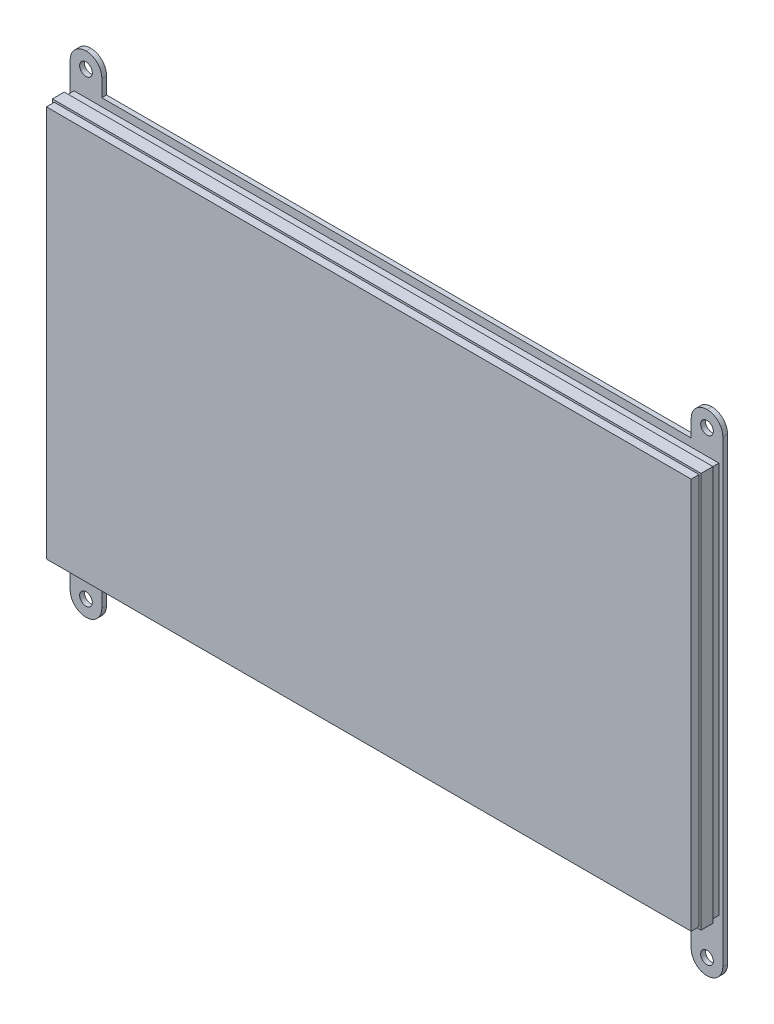
from build123d import *

# Parameters (mm, degrees)
ESQUISSE1_R             = 1.6
BOSS_EXTRU_1_DEPTH      = 1.2
ESQUISSE1_3_W           = 163
ESQUISSE1_3_H           = 99
BOSS_EXTRU_2_DEPTH      = 2
ESQUISSE3_W             = 164
ESQUISSE3_H             = 100
BOSS_EXTRU_4_DEPTH      = 3
ESQUISSE4_W             = 163
ESQUISSE4_H             = 99
BOSS_EXTRU_5_DEPTH      = 2
ESQUISSE5_W             = 37.5
ESQUISSE5_H             = 5
ESQUISSE5_W_2           = 5
ESQUISSE5_H_2           = 2
ENL_V_MAT_EXTRU_1_DEPTH = 1.2
ESQUISSE6_W             = 0.664850428
ESQUISSE6_H             = 2.706891026
ESQUISSE6_W_2           = 0.664850427
ESQUISSE6_H_2           = 3.704166667
ESQUISSE6_H_3           = 3.799145299
ESQUISSE6_W_3           = 1.282211538
ESQUISSE6_H_4           = 0.617361111
ENL_V_MAT_EXTRU_2_DEPTH = 0.1
ESQUISSE7_W             = 0.474893162
ESQUISSE7_H             = 2.713675214
ESQUISSE7_H_2           = 1.93349359
ENL_V_MAT_EXTRU_3_DEPTH = 0.1


with BuildPart() as part:
    # Esquisse1 → Boss.-Extru.1 (new body)
    with BuildSketch(Plane.XY):
        with BuildLine():
            Line((74.5, 53.75), (-74.5, 53.75))
            Line((-74.5, 53.75), (-74.5, 58.01))
            ThreePointArc((-74.5, 58.01), (-75.668643943, 60.831356057), (-78.49, 62))
            Line((-78.49, 62), (-78.51, 62))
            ThreePointArc((-78.51, 62), (-81.331356057, 60.831356057), (-82.5, 58.01))
            Line((-82.5, 58.01), (-82.5, -58.01))
            ThreePointArc((-82.5, -58.01), (-81.331356057, -60.831356057), (-78.51, -62))
            Line((-78.51, -62), (-78.49, -62))
            ThreePointArc((-78.49, -62), (-75.668643943, -60.831356057), (-74.5, -58.01))
            Line((-74.5, -58.01), (-74.5, -53.75))
            Line((-74.5, -53.75), (74.5, -53.75))
            Line((74.5, -53.75), (74.5, -58.01))
            ThreePointArc((74.5, -58.01), (75.668643943, -60.831356057), (78.49, -62))
            Line((78.49, -62), (78.51, -62))
            ThreePointArc((78.51, -62), (81.331356057, -60.831356057), (82.5, -58.01))
            Line((82.5, -58.01), (82.5, 58.01))
            ThreePointArc((82.5, 58.01), (81.331356057, 60.831356057), (78.51, 62))
            Line((78.51, 62), (78.49, 62))
            ThreePointArc((78.49, 62), (75.668643943, 60.831356057), (74.5, 58.01))
            Line((74.5, 58.01), (74.5, 53.75))
        make_face()
        with Locations(Location((-78.5, -58, 0), (0, 0, 180))):
            Circle(ESQUISSE1_R, mode=Mode.SUBTRACT)
        with Locations((78.5, -58)):
            Circle(ESQUISSE1_R, mode=Mode.SUBTRACT)
        with Locations((-78.5, 58)):
            Circle(ESQUISSE1_R, mode=Mode.SUBTRACT)
        with Locations(Location((78.5, 58, 0), (0, 0, 180))):
            Circle(ESQUISSE1_R, mode=Mode.SUBTRACT)
    extrude(amount=-BOSS_EXTRU_1_DEPTH)

    # Esquisse1<3> → Boss.-Extru.2 (add)
    with BuildSketch(Plane.XY):
        with Locations((0, 2.25)):
            Rectangle(ESQUISSE1_3_W, ESQUISSE1_3_H)
    extrude(amount=BOSS_EXTRU_2_DEPTH)

    # Esquisse3 → Boss.-Extru.4 (add)
    with BuildSketch(Plane.XY.offset(2)):
        with Locations((0, 2.25)):
            Rectangle(ESQUISSE3_W, ESQUISSE3_H)
    extrude(amount=BOSS_EXTRU_4_DEPTH)

    # Esquisse4 → Boss.-Extru.5 (add)
    with BuildSketch(Plane.XY.offset(5)):
        with Locations((0, 2.25)):
            Rectangle(ESQUISSE4_W, ESQUISSE4_H)
    extrude(amount=BOSS_EXTRU_5_DEPTH)

    # Esquisse5 → Enlèv. mat.-Extru.1 (cut)
    with BuildSketch(Plane(origin=(0, 0, -1.2), x_dir=(-1, 0, 0), z_dir=(0, 0, -1))):
        with Locations((0, -31.75)):
            Rectangle(ESQUISSE5_W, ESQUISSE5_H)
        with Locations((-57.5, 10.75)):
            Rectangle(ESQUISSE5_W_2, ESQUISSE5_H_2)
    extrude(amount=-ENL_V_MAT_EXTRU_1_DEPTH, mode=Mode.SUBTRACT)

    # Esquisse6 → Enlèv. mat.-Extru.2 (cut)
    # profile 1 of 20: a face of its own
    with BuildSketch(Plane(origin=(0, 0, -1.2), x_dir=(-1, 0, 0), z_dir=(0, 0, -1))):
        Polygon((24.054727564, -30.545833333), (26.429193376, -30.545833333), (26.429193376, -30.890872897), (24.795264089, -34.344978632), (24.20609976, -34.048170406), (25.571417601, -31.163194444), (24.054727564, -31.163194444), align=None)
    # profile 2 of 20: a face of its own
    with BuildSketch(Plane(origin=(0, 0, -1.2), x_dir=(-1, 0, 0), z_dir=(0, 0, -1))):
        with BuildLine():
            add(Edge.make_bspline(
                [(27.235027711, -30.403365385), (27.26368276, -30.40477131), (27.319949709, -30.407531979), (27.40055977, -30.434442366), (27.474543469, -30.476677413), (27.539947111, -30.534624904), (27.594343745, -30.603824808), (27.635904793, -30.681298701), (27.659056722, -30.767137279), (27.662272182, -30.826433671), (27.663915598, -30.856739951)],
                knots=[0, 0, 0, 0, 0.989868614, 1.943702388, 2.910836514, 3.924849579, 4.949916355, 5.946401046, 6.950409252, 8, 8, 8, 8], degree=3))
            add(Edge.make_bspline(
                [(27.663915598, -30.856739951), (27.662330981, -30.88682289), (27.659243278, -30.945440929), (27.635371937, -31.030114209), (27.595479005, -31.107550472), (27.540641793, -31.175722629), (27.475947212, -31.232736842), (27.403580113, -31.275738641), (27.32374253, -31.301152009), (27.268348674, -31.304143455), (27.240221855, -31.305662393)],
                knots=[0, 0, 0, 0, 1.05296456, 2.051751585, 3.055639087, 4.085634717, 5.099016424, 6.062201612, 7.016062274, 8, 8, 8, 8], degree=3))
            add(Edge.make_bspline(
                [(27.240221855, -31.305662393), (27.211316671, -31.304261494), (27.154560202, -31.301510773), (27.073288972, -31.274537423), (26.99831852, -31.232635004), (26.933198598, -31.173503555), (26.878179002, -31.103811934), (26.838433356, -31.024534382), (26.813571472, -30.938108841), (26.810620388, -30.87793423), (26.809107906, -30.847093683)],
                knots=[0, 0, 0, 0, 0.989065327, 1.942068821, 2.907541208, 3.917690034, 4.939857478, 5.938239964, 6.943311734, 8, 8, 8, 8], degree=3))
            add(Edge.make_bspline(
                [(26.809107906, -30.847093683), (26.8107539, -30.81752157), (26.813987218, -30.759431424), (26.83727783, -30.675501289), (26.877885885, -30.599329853), (26.931890694, -30.531396718), (26.996719872, -30.474530166), (27.070659157, -30.433577825), (27.15072671, -30.407778914), (27.206637228, -30.404851752), (27.235027711, -30.403365385)],
                knots=[0, 0, 0, 0, 1.038616768, 2.040212704, 3.031499824, 4.052181184, 5.074969369, 6.039807101, 7.004644834, 8, 8, 8, 8], degree=3))
        make_face()
    # profile 3 of 20: a face of its own
    with BuildSketch(Plane(origin=(0, 0, -1.2), x_dir=(-1, 0, 0), z_dir=(0, 0, -1))):
        with Locations((27.236511752, -32.896554487)):
            Rectangle(ESQUISSE6_W, ESQUISSE6_H)
    # profile 4 of 20: a face of its own
    with BuildSketch(Plane(origin=(0, 0, -1.2), x_dir=(-1, 0, 0), z_dir=(0, 0, -1))):
        with BuildLine():
            Line((28.186298077, -31.543108974), (28.851148504, -31.543108974))
            Line((28.851148504, -31.543108974), (28.851148504, -31.829528913))
            add(Edge.make_bspline(
                [(28.851148504, -31.829528913), (28.889077892, -31.800026654), (28.961568324, -31.743642103), (29.071766297, -31.671751513), (29.17577954, -31.612911951), (29.27592662, -31.56815557), (29.374091806, -31.535955278), (29.471864955, -31.512821289), (29.570702105, -31.49800796), (29.637144662, -31.496415332), (29.670339209, -31.495619658)],
                knots=[0, 0, 0, 0, 1.276643801, 2.439914479, 3.493451431, 4.44993799, 5.350072675, 6.235028322, 7.118224225, 8, 8, 8, 8], degree=3))
            add(Edge.make_bspline(
                [(29.670339209, -31.495619658), (29.704010611, -31.496528948), (29.770110401, -31.498313961), (29.867438699, -31.510798681), (29.960426435, -31.53353731), (30.050119181, -31.56372806), (30.135604017, -31.603578118), (30.217928185, -31.650893597), (30.29532339, -31.708527051), (30.342986784, -31.752417922), (30.367096521, -31.774619391)],
                knots=[0, 0, 0, 0, 1.048836932, 2.058954983, 3.049370783, 4.026390553, 5.001981509, 5.982488534, 6.97947532, 8, 8, 8, 8], degree=3))
            add(Edge.make_bspline(
                [(30.367096521, -31.774619391), (30.386433417, -31.79519366), (30.425248733, -31.836492778), (30.474092931, -31.907166146), (30.516006746, -31.984213054), (30.550349294, -32.068522261), (30.575727054, -32.160556993), (30.595250511, -32.259205601), (30.606205463, -32.365020445), (30.607557903, -32.437714244), (30.608253205, -32.475086806)],
                knots=[0, 0, 0, 0, 0.889584746, 1.785680191, 2.700364693, 3.65222533, 4.649950538, 5.707241244, 6.821271309, 8, 8, 8, 8], degree=3))
            Line((30.608253205, -32.475086806), (30.608253205, -34.25))
            Line((30.608253205, -34.25), (29.943402778, -34.25))
            Line((29.943402778, -34.25), (29.943402778, -33.074639423))
            add(Edge.make_bspline(
                [(29.943402778, -33.074639423), (29.943262177, -33.036301209), (29.942992741, -32.962833136), (29.940924068, -32.857689284), (29.936884813, -32.762730731), (29.933203138, -32.677784585), (29.925974546, -32.603152463), (29.919455684, -32.538361885), (29.909453124, -32.484000637), (29.89643817, -32.425526959), (29.873710855, -32.362920193), (29.838427806, -32.296953622), (29.79366631, -32.240913549), (29.741254607, -32.194407106), (29.68125058, -32.157616244), (29.614379291, -32.13173158), (29.540999249, -32.115599623), (29.489868898, -32.113875931), (29.463315471, -32.112980769)],
                knots=[0, 0, 0, 0, 1.49886392, 2.872294502, 4.110984203, 5.214877267, 6.195405875, 7.042225351, 7.75923308, 8.355011229, 9.382752534, 10.352059385, 11.267231453, 12.171456522, 13.078624015, 14.003401117, 14.963110155, 16, 16, 16, 16], degree=3))
            add(Edge.make_bspline(
                [(29.463315471, -32.112980769), (29.428781623, -32.11473199), (29.361226703, -32.118157718), (29.263522026, -32.143990833), (29.173781908, -32.187925357), (29.092739599, -32.248721905), (29.021166961, -32.323782776), (28.962217837, -32.413301475), (28.913867445, -32.515117475), (28.893076058, -32.589459692), (28.882313368, -32.627943042)],
                knots=[0, 0, 0, 0, 0.984188326, 1.925263693, 2.85911992, 3.81709677, 4.80007086, 5.801799564, 6.862098548, 8, 8, 8, 8], degree=3))
            add(Edge.make_bspline(
                [(28.882313368, -32.627943042), (28.879638412, -32.640028996), (28.873672722, -32.666983104), (28.868766697, -32.712519122), (28.86194206, -32.766543198), (28.859385036, -32.830033017), (28.854938653, -32.902688108), (28.853294169, -32.98460459), (28.851646741, -33.075621841), (28.851320085, -33.139193933), (28.851148504, -33.172586138)],
                knots=[0, 0, 0, 0, 0.543362196, 1.211806945, 2.009705693, 2.934833164, 4.000995085, 5.207458376, 6.533175157, 8, 8, 8, 8], degree=3))
            Line((28.851148504, -33.172586138), (28.851148504, -34.25))
            Line((28.851148504, -34.25), (28.186298077, -34.25))
            Line((28.186298077, -34.25), (28.186298077, -31.543108974))
        make_face()
    # profile 5 of 20: a face of its own
    with BuildSketch(Plane(origin=(0, 0, -1.2), x_dir=(-1, 0, 0), z_dir=(0, 0, -1))):
        with BuildLine():
            Line((33.885016026, -32.095172276), (33.334436765, -32.397916667))
            add(Edge.make_bspline(
                [(33.334436765, -32.397916667), (33.309200219, -32.372644489), (33.260689232, -32.324065009), (33.182897965, -32.262571095), (33.106496726, -32.211655845), (33.028335807, -32.174083005), (32.947716544, -32.145787056), (32.861731097, -32.127046027), (32.769375865, -32.114705725), (32.705493646, -32.113567609), (32.67255442, -32.112980769)],
                knots=[0, 0, 0, 0, 1.150764855, 2.212059359, 3.192108068, 4.105322427, 5.000809612, 5.941206042, 6.938435785, 8, 8, 8, 8], degree=3))
            add(Edge.make_bspline(
                [(32.67255442, -32.112980769), (32.642346878, -32.113710393), (32.583233249, -32.115138205), (32.496858858, -32.125802984), (32.414768849, -32.142553284), (32.337110581, -32.167059033), (32.264022369, -32.19943246), (32.194899805, -32.237741542), (32.13041458, -32.283482579), (32.071478208, -32.336005374), (32.018277774, -32.393831807), (31.970820273, -32.455506184), (31.931941372, -32.521943428), (31.898328151, -32.591582023), (31.873615301, -32.665729939), (31.855534779, -32.74371436), (31.845229049, -32.82553874), (31.843735931, -32.881438772), (31.842975427, -32.909910857)],
                knots=[0, 0, 0, 0, 1.121765476, 2.195200973, 3.227634963, 4.230038321, 5.213228299, 6.192116585, 7.160777141, 8.14345191, 9.118668839, 10.075979138, 11.027630062, 11.972829041, 12.943187208, 13.923755399, 14.94248691, 16, 16, 16, 16], degree=3))
            add(Edge.make_bspline(
                [(31.842975427, -32.909910857), (31.843778965, -32.937639916), (31.84534793, -32.991782866), (31.854987119, -33.071331763), (31.871721115, -33.147058918), (31.89681155, -33.218563984), (31.926885243, -33.286506137), (31.964652295, -33.350345019), (32.009064267, -33.410359397), (32.060354972, -33.466027661), (32.117172056, -33.516094434), (32.178425328, -33.560308578), (32.243932033, -33.597793992), (32.314455259, -33.627211618), (32.388845196, -33.651180828), (32.467598621, -33.668247845), (32.550631729, -33.677721219), (32.607233297, -33.679313474), (32.636195413, -33.680128205)],
                knots=[0, 0, 0, 0, 1.070556293, 2.090336998, 3.088792742, 4.058148387, 5.011235098, 5.952916408, 6.915475435, 7.888633318, 8.869583867, 9.83422472, 10.800707077, 11.776204622, 12.778807041, 13.814557445, 14.881744048, 16, 16, 16, 16], degree=3))
            add(Edge.make_bspline(
                [(32.636195413, -33.680128205), (32.671854719, -33.679312216), (32.741456502, -33.677719524), (32.842637296, -33.664210819), (32.937847038, -33.641872172), (33.027095826, -33.610953711), (33.110258799, -33.570527247), (33.187122275, -33.521149337), (33.258476409, -33.463184234), (33.300086209, -33.417993335), (33.321080395, -33.395192308)],
                knots=[0, 0, 0, 0, 1.116373375, 2.178998604, 3.189797796, 4.174590301, 5.13072713, 6.078291395, 7.030403691, 8, 8, 8, 8], degree=3))
            Line((33.321080395, -33.395192308), (33.837526709, -33.749878138))
            add(Edge.make_bspline(
                [(33.837526709, -33.749878138), (33.801729131, -33.793645204), (33.731085333, -33.88001618), (33.607831496, -33.991345216), (33.475173138, -34.087001594), (33.330442215, -34.163353304), (33.175746487, -34.224081328), (33.009877155, -34.267010012), (32.833114776, -34.292280299), (32.711717485, -34.295725223), (32.649551783, -34.297489316)],
                knots=[0, 0, 0, 0, 0.997876357, 1.969233105, 2.924898516, 3.881013542, 4.852507933, 5.855329832, 6.901747111, 8, 8, 8, 8], degree=3))
            add(Edge.make_bspline(
                [(32.649551783, -34.297489316), (32.593598796, -34.296195849), (32.484316442, -34.293669565), (32.325040127, -34.274322998), (32.175232482, -34.24173634), (32.03458533, -34.196480168), (31.9032269, -34.13785648), (31.781583199, -34.065141202), (31.668833743, -33.980357008), (31.567012985, -33.883103383), (31.476165505, -33.777241761), (31.396855328, -33.665752641), (31.328264259, -33.550633585), (31.274454632, -33.429968479), (31.230477337, -33.305638095), (31.200776452, -33.176156238), (31.181186889, -33.042589469), (31.179153845, -32.952029577), (31.178125, -32.906200755)],
                knots=[0, 0, 0, 0, 1.183377041, 2.311265848, 3.387807024, 4.421911742, 5.431260577, 6.423665966, 7.413571885, 8.409103097, 9.395976332, 10.359992013, 11.300391101, 12.225292883, 13.150239058, 14.085544813, 15.031169026, 16, 16, 16, 16], degree=3))
            add(Edge.make_bspline(
                [(31.178125, -32.906200755), (31.17867616, -32.874271425), (31.179767837, -32.811029241), (31.18908731, -32.717107544), (31.203585279, -32.624779661), (31.225374014, -32.534693685), (31.252170313, -32.446412551), (31.284744842, -32.359954007), (31.324382461, -32.275764191), (31.368598346, -32.193126935), (31.41899214, -32.114223742), (31.473970725, -32.039089434), (31.533456639, -31.968184174), (31.598148693, -31.902168781), (31.667595811, -31.840570889), (31.740788414, -31.782140788), (31.820094978, -31.729891856), (31.9027585, -31.680768208), (31.989491042, -31.6370387), (32.079295731, -31.59929437), (32.171478578, -31.567225117), (32.26626054, -31.541440791), (32.363234795, -31.520189779), (32.463264242, -31.506703014), (32.565521304, -31.497223456), (32.63468886, -31.49615748), (32.669586338, -31.495619658)],
                knots=[0, 0, 0, 0, 1.00272354, 1.986087015, 2.96193297, 3.936200312, 4.894695956, 5.858592327, 6.835334787, 7.815655071, 8.800643866, 9.773423113, 10.738352213, 11.705312252, 12.673769326, 13.65298065, 14.64420052, 15.654211674, 16.672258995, 17.692438602, 18.712115155, 19.735602823, 20.776372304, 21.827874031, 22.90408564, 24, 24, 24, 24], degree=3))
            add(Edge.make_bspline(
                [(32.669586338, -31.495619658), (32.702001618, -31.49598614), (32.765931404, -31.496708921), (32.860341246, -31.504266597), (32.95217578, -31.517103642), (33.04159129, -31.534086511), (33.128859331, -31.555131244), (33.212810279, -31.583183167), (33.294591885, -31.615021045), (33.399927457, -31.663092915), (33.524098817, -31.734847961), (33.660405703, -31.837760516), (33.781939793, -31.958153196), (33.850474661, -32.049256492), (33.885016026, -32.095172276)],
                knots=[0, 0, 0, 0, 0.826738014, 1.630502179, 2.413926014, 3.191023582, 3.95155221, 4.701751672, 5.446919844, 6.189438973, 7.653650558, 9.094719814, 10.535747635, 12, 12, 12, 12], degree=3))
        make_face()
    # profile 6 of 20: a face of its own
    with BuildSketch(Plane(origin=(0, 0, -1.2), x_dir=(-1, 0, 0), z_dir=(0, 0, -1))):
        with BuildLine():
            Line((34.549866453, -30.450854701), (35.21471688, -30.450854701))
            Line((35.21471688, -30.450854701), (35.21471688, -31.836207098))
            add(Edge.make_bspline(
                [(35.21471688, -31.836207098), (35.248206806, -31.808971113), (35.313484473, -31.755883458), (35.415907273, -31.68672284), (35.518118224, -31.627705042), (35.621201935, -31.579875152), (35.724711192, -31.542393668), (35.828824737, -31.515812425), (35.933642799, -31.498372784), (36.003911262, -31.496538345), (36.039101729, -31.495619658)],
                knots=[0, 0, 0, 0, 1.13710654, 2.216417683, 3.252896077, 4.244436563, 5.207303112, 6.149540546, 7.073289332, 8, 8, 8, 8], degree=3))
            add(Edge.make_bspline(
                [(36.039101729, -31.495619658), (36.072776645, -31.496513194), (36.138883333, -31.498267281), (36.235865851, -31.510937296), (36.328755737, -31.532739125), (36.417781818, -31.562709519), (36.502331614, -31.603015284), (36.5835046, -31.650228399), (36.660335927, -31.706794127), (36.707083413, -31.750397748), (36.730664897, -31.772393329)],
                knots=[0, 0, 0, 0, 1.056403236, 2.073808271, 3.062028718, 4.046096703, 5.014652014, 5.995532726, 6.988858718, 8, 8, 8, 8], degree=3))
            add(Edge.make_bspline(
                [(36.730664897, -31.772393329), (36.750031521, -31.792946185), (36.789045758, -31.834350098), (36.837636949, -31.905729488), (36.879594957, -31.983479357), (36.913784752, -32.068330313), (36.939212229, -32.160321854), (36.958898252, -32.258696141), (36.969785041, -32.364527309), (36.971128621, -32.437467465), (36.971821581, -32.475086806)],
                knots=[0, 0, 0, 0, 0.887296576, 1.787466942, 2.706642908, 3.663267187, 4.658426068, 5.705361056, 6.816525637, 8, 8, 8, 8], degree=3))
            Line((36.971821581, -32.475086806), (36.971821581, -34.25))
            Line((36.971821581, -34.25), (36.306971154, -34.25))
            Line((36.306971154, -34.25), (36.306971154, -33.073155382))
            add(Edge.make_bspline(
                [(36.306971154, -33.073155382), (36.306841972, -33.035805887), (36.306594705, -32.964315099), (36.304374238, -32.861652452), (36.300748147, -32.768387362), (36.295789302, -32.684491643), (36.288865672, -32.610315911), (36.282055794, -32.545328502), (36.27249994, -32.489840923), (36.25819126, -32.429548396), (36.234905148, -32.365060672), (36.201066638, -32.296319531), (36.155867685, -32.239586961), (36.103561076, -32.192796815), (36.043082409, -32.157084805), (35.976596761, -32.130708535), (35.902967523, -32.115875172), (35.851931049, -32.11397077), (35.825399806, -32.112980769)],
                knots=[0, 0, 0, 0, 1.461461505, 2.797388094, 4.017818807, 5.113567707, 6.085313608, 6.932873269, 7.669572396, 8.286941306, 9.355291607, 10.346554054, 11.270113241, 12.175128673, 13.078071705, 14.003657132, 14.962203834, 16, 16, 16, 16], degree=3))
            add(Edge.make_bspline(
                [(35.825399806, -32.112980769), (35.790837457, -32.114331925), (35.7231432, -32.116978317), (35.626066642, -32.144219752), (35.536526287, -32.187278298), (35.455567156, -32.246955506), (35.385019865, -32.321703585), (35.325912122, -32.409315799), (35.277565225, -32.508915835), (35.256668825, -32.581545903), (35.245881744, -32.619038795)],
                knots=[0, 0, 0, 0, 0.993549393, 1.945978497, 2.879753144, 3.843180486, 4.826017097, 5.826060929, 6.877775219, 8, 8, 8, 8], degree=3))
            add(Edge.make_bspline(
                [(35.245881744, -32.619038795), (35.243195738, -32.630627303), (35.237070765, -32.657052892), (35.232380144, -32.702139486), (35.225419338, -32.756641452), (35.223004746, -32.820885395), (35.218481643, -32.894772227), (35.216854958, -32.978421489), (35.215217298, -33.071911826), (35.214889049, -33.137462546), (35.21471688, -33.171844117)],
                knots=[0, 0, 0, 0, 0.514379255, 1.17295301, 1.959069106, 2.891908278, 3.953016936, 5.163065833, 6.51201855, 8, 8, 8, 8], degree=3))
            Line((35.21471688, -33.171844117), (35.21471688, -34.25))
            Line((35.21471688, -34.25), (34.549866453, -34.25))
            Line((34.549866453, -34.25), (34.549866453, -30.450854701))
        make_face()
    # profile 7 of 20: a face of its own
    with BuildSketch(Plane(origin=(0, 0, -1.2), x_dir=(-1, 0, 0), z_dir=(0, 0, -1))):
        Polygon((39.156330128, -30.545833333), (39.821180556, -30.545833333), (39.821180556, -31.970512821), (41.103392094, -31.970512821), (41.103392094, -30.545833333), (41.768242521, -30.545833333), (41.768242521, -34.25), (41.103392094, -34.25), (41.103392094, -32.635363248), (39.821180556, -32.635363248), (39.821180556, -34.25), (39.156330128, -34.25), align=None)
    # profile 8 of 20: a face of its own
    with BuildSketch(Plane(origin=(0, 0, -1.2), x_dir=(-1, 0, 0), z_dir=(0, 0, -1))):
        with BuildLine():
            Line((42.623050214, -30.545833333), (43.460791433, -30.545833333))
            add(Edge.make_bspline(
                [(43.460791433, -30.545833333), (43.526102997, -30.546289884), (43.652350988, -30.5471724), (43.835259351, -30.557116241), (44.005340853, -30.572409161), (44.162705132, -30.593447345), (44.307029566, -30.621286624), (44.438128052, -30.656205543), (44.556440586, -30.696513625), (44.663264442, -30.743944263), (44.760784349, -30.799243676), (44.853382612, -30.860842784), (44.940877418, -30.930998139), (45.024496617, -31.008356308), (45.103161087, -31.094332532), (45.178180872, -31.187502734), (45.247719149, -31.289218012), (45.313877907, -31.397039552), (45.373709701, -31.511424293), (45.425897227, -31.631398616), (45.469615035, -31.756190441), (45.505138017, -31.885932763), (45.533453933, -32.020194879), (45.55326601, -32.159247715), (45.565514032, -32.302962532), (45.566756492, -32.400365121), (45.567387821, -32.449858106)],
                knots=[0, 0, 0, 0, 1.44355588, 2.790409838, 4.047694926, 5.217575253, 6.298404546, 7.294384826, 8.214239204, 9.058592145, 9.873746385, 10.689560431, 11.514393297, 12.350027578, 13.205127629, 14.088021785, 14.991911688, 15.926770944, 16.882954281, 17.842803888, 18.816321264, 19.80318086, 20.814351908, 21.847355356, 22.906180909, 24, 24, 24, 24], degree=3))
            add(Edge.make_bspline(
                [(45.567387821, -32.449858106), (45.565734662, -32.519695931), (45.562480322, -32.657175776), (45.53506758, -32.858925865), (45.490731894, -33.052323448), (45.428391892, -33.235855693), (45.351106979, -33.407888219), (45.258781496, -33.565387305), (45.152769149, -33.707507575), (45.034304989, -33.833541387), (44.906037155, -33.941869156), (44.772741011, -34.034643963), (44.633118008, -34.10780464), (44.51009063, -34.154199449), (44.403410545, -34.183053007), (44.309746584, -34.200105737), (44.203353881, -34.21574412), (44.083240417, -34.227829125), (43.949933103, -34.23860598), (43.802900575, -34.244461703), (43.642618882, -34.24932694), (43.531288092, -34.249769768), (43.473405783, -34.25)],
                knots=[0, 0, 0, 0, 1.315458931, 2.589557908, 3.828601765, 5.048913369, 6.235739168, 7.376350998, 8.481830359, 9.569842114, 10.627874879, 11.640079404, 12.624025415, 13.590060155, 14.111227486, 14.704434459, 15.382649715, 16.137166398, 16.978595427, 17.902333227, 18.909396075, 20, 20, 20, 20], degree=3))
            Line((43.473405783, -34.25), (42.623050214, -34.25))
            Line((42.623050214, -34.25), (42.623050214, -30.545833333))
        make_face()
        with BuildLine():
            Line((43.287900641, -31.210683761), (43.287900641, -33.585149573))
            Line((43.287900641, -33.585149573), (43.635166266, -33.585149573))
            add(Edge.make_bspline(
                [(43.635166266, -33.585149573), (43.676485542, -33.585073859), (43.755956266, -33.584928235), (43.870694001, -33.577992073), (43.976797314, -33.57103008), (44.073974126, -33.557815983), (44.162931661, -33.543096408), (44.242447874, -33.522612105), (44.314161941, -33.50109508), (44.377197887, -33.47370124), (44.434933678, -33.44286765), (44.488390425, -33.406742525), (44.539991153, -33.366626936), (44.588771145, -33.321341026), (44.63491502, -33.271484466), (44.678149763, -33.216800368), (44.719052443, -33.157455574), (44.756573165, -33.093136313), (44.790859802, -33.024521812), (44.821275891, -32.952276702), (44.846495317, -32.875799336), (44.867456159, -32.795805635), (44.882435058, -32.711599163), (44.89482724, -32.623803626), (44.901215771, -32.532071185), (44.902092557, -32.469653366), (44.902537393, -32.437985777)],
                knots=[0, 0, 0, 0, 1.50275155, 2.890291501, 4.180787663, 5.369391935, 6.45668281, 7.458360028, 8.354766181, 9.177074746, 9.954075863, 10.732690366, 11.5210699, 12.329727389, 13.151100085, 13.990027547, 14.863562427, 15.770965086, 16.696477834, 17.652329173, 18.619756807, 19.62365428, 20.657822005, 21.729286259, 22.847956731, 24, 24, 24, 24], degree=3))
            add(Edge.make_bspline(
                [(44.902537393, -32.437985777), (44.901651431, -32.389458192), (44.899923872, -32.29483316), (44.883263675, -32.157009736), (44.856144051, -32.027228335), (44.817446961, -31.905970611), (44.768668079, -31.792895766), (44.707609938, -31.688961784), (44.636900245, -31.592422717), (44.580984949, -31.535789803), (44.553045706, -31.507491987)],
                knots=[0, 0, 0, 0, 1.13821349, 2.219428113, 3.251817212, 4.244760574, 5.201143372, 6.134805572, 7.068016741, 8, 8, 8, 8], degree=3))
            add(Edge.make_bspline(
                [(44.553045706, -31.507491987), (44.525494968, -31.483378423), (44.469225703, -31.434129198), (44.370435366, -31.375116032), (44.261573531, -31.323267181), (44.140149765, -31.282156824), (44.007337576, -31.249645002), (43.862345931, -31.227222393), (43.705951292, -31.212813862), (43.597604731, -31.211409006), (43.541671675, -31.210683761)],
                knots=[0, 0, 0, 0, 0.813307809, 1.661089106, 2.549956539, 3.493439533, 4.508053171, 5.589449661, 6.755572447, 8, 8, 8, 8], degree=3))
            Line((43.541671675, -31.210683761), (43.287900641, -31.210683761))
        make_face(mode=Mode.SUBTRACT)
    # profile 9 of 20: a face of its own
    with BuildSketch(Plane(origin=(0, 0, -1.2), x_dir=(-1, 0, 0), z_dir=(0, 0, -1))):
        Polygon((46.525336372, -30.545833333), (47.215415498, -30.545833333), (48.060576923, -33.129548945), (48.911674513, -30.545833333), (49.595075454, -30.545833333), (50.221340812, -34.25), (49.548328158, -34.25), (49.152831197, -31.910409155), (48.382613849, -34.25), (47.734087874, -34.25), (46.96832265, -31.910409155), (46.573567708, -34.25), (45.899813034, -34.25), align=None)
    # profile 10 of 20: a face of its own
    with BuildSketch(Plane(origin=(0, 0, -1.2), x_dir=(-1, 0, 0), z_dir=(0, 0, -1))):
        with Locations((51.076148505, -32.397916667)):
            Rectangle(ESQUISSE6_W_2, ESQUISSE6_H_2)
    # profile 11 of 20: a face of its own
    with BuildSketch(Plane(origin=(0, 0, -1.2), x_dir=(-1, 0, 0), z_dir=(0, 0, -1))):
        with BuildLine():
            Line((53.688060897, -30.545833333), (54.525802117, -30.545833333))
            add(Edge.make_bspline(
                [(54.525802117, -30.545833333), (54.59111368, -30.546289884), (54.717361672, -30.5471724), (54.900270035, -30.557116241), (55.070351537, -30.572409161), (55.227715816, -30.593447345), (55.37204025, -30.621286624), (55.503138735, -30.656205543), (55.62145127, -30.696513625), (55.728275126, -30.743944263), (55.825795032, -30.799243676), (55.918393295, -30.860842784), (56.005888101, -30.930998139), (56.089507301, -31.008356308), (56.168171771, -31.094332532), (56.243191556, -31.187502734), (56.312729832, -31.289218012), (56.378888591, -31.397039552), (56.438720385, -31.511424293), (56.490907911, -31.631398616), (56.534625718, -31.756190441), (56.570148701, -31.885932763), (56.598464617, -32.020194879), (56.618276693, -32.159247715), (56.630524716, -32.302962532), (56.631767176, -32.400365121), (56.632398504, -32.449858106)],
                knots=[0, 0, 0, 0, 1.44355588, 2.790409838, 4.047694926, 5.217575253, 6.298404546, 7.294384826, 8.214239204, 9.058592145, 9.873746385, 10.689560431, 11.514393297, 12.350027578, 13.205127629, 14.088021785, 14.991911688, 15.926770944, 16.882954281, 17.842803888, 18.816321264, 19.80318086, 20.814351908, 21.847355356, 22.906180909, 24, 24, 24, 24], degree=3))
            add(Edge.make_bspline(
                [(56.632398504, -32.449858106), (56.630745345, -32.519695931), (56.627491005, -32.657175776), (56.600078263, -32.858925865), (56.555742577, -33.052323448), (56.493402576, -33.235855693), (56.416117663, -33.407888219), (56.323792179, -33.565387305), (56.217779832, -33.707507575), (56.099315672, -33.833541387), (55.971047839, -33.941869156), (55.837751694, -34.034643963), (55.698128692, -34.10780464), (55.575101314, -34.154199449), (55.468421228, -34.183053007), (55.374757268, -34.200105737), (55.268364565, -34.21574412), (55.148251101, -34.227829125), (55.014943787, -34.23860598), (54.867911259, -34.244461703), (54.707629566, -34.24932694), (54.596298776, -34.249769768), (54.538416466, -34.25)],
                knots=[0, 0, 0, 0, 1.315458931, 2.589557908, 3.828601765, 5.048913369, 6.235739168, 7.376350998, 8.481830359, 9.569842114, 10.627874879, 11.640079404, 12.624025415, 13.590060155, 14.111227486, 14.704434459, 15.382649715, 16.137166398, 16.978595427, 17.902333227, 18.909396075, 20, 20, 20, 20], degree=3))
            Line((54.538416466, -34.25), (53.688060897, -34.25))
            Line((53.688060897, -34.25), (53.688060897, -30.545833333))
        make_face()
        with BuildLine():
            Line((54.352911325, -31.210683761), (54.352911325, -33.585149573))
            Line((54.352911325, -33.585149573), (54.70017695, -33.585149573))
            add(Edge.make_bspline(
                [(54.70017695, -33.585149573), (54.741496226, -33.585073859), (54.820966949, -33.584928235), (54.935704685, -33.577992073), (55.041807998, -33.57103008), (55.13898481, -33.557815983), (55.227942345, -33.543096408), (55.307458558, -33.522612105), (55.379172624, -33.50109508), (55.442208571, -33.47370124), (55.499944362, -33.44286765), (55.553401109, -33.406742525), (55.605001837, -33.366626936), (55.653781829, -33.321341026), (55.699925704, -33.271484466), (55.743160447, -33.216800368), (55.784063126, -33.157455574), (55.821583849, -33.093136313), (55.855870485, -33.024521812), (55.886286574, -32.952276702), (55.911506, -32.875799336), (55.932466843, -32.795805635), (55.947445742, -32.711599163), (55.959837924, -32.623803626), (55.966226455, -32.532071185), (55.967103241, -32.469653366), (55.967548077, -32.437985777)],
                knots=[0, 0, 0, 0, 1.50275155, 2.890291501, 4.180787663, 5.369391935, 6.45668281, 7.458360028, 8.354766181, 9.177074746, 9.954075863, 10.732690366, 11.5210699, 12.329727389, 13.151100085, 13.990027547, 14.863562427, 15.770965086, 16.696477834, 17.652329173, 18.619756807, 19.62365428, 20.657822005, 21.729286259, 22.847956731, 24, 24, 24, 24], degree=3))
            add(Edge.make_bspline(
                [(55.967548077, -32.437985777), (55.966662114, -32.389458192), (55.964934556, -32.29483316), (55.948274358, -32.157009736), (55.921154735, -32.027228335), (55.882457645, -31.905970611), (55.833678763, -31.792895766), (55.772620622, -31.688961784), (55.701910929, -31.592422717), (55.645995633, -31.535789803), (55.61805639, -31.507491987)],
                knots=[0, 0, 0, 0, 1.13821349, 2.219428113, 3.251817212, 4.244760574, 5.201143372, 6.134805572, 7.068016741, 8, 8, 8, 8], degree=3))
            add(Edge.make_bspline(
                [(55.61805639, -31.507491987), (55.590505651, -31.483378423), (55.534236387, -31.434129198), (55.43544605, -31.375116032), (55.326584214, -31.323267181), (55.205160449, -31.282156824), (55.07234826, -31.249645002), (54.927356615, -31.227222393), (54.770961976, -31.212813862), (54.662615414, -31.211409006), (54.606682358, -31.210683761)],
                knots=[0, 0, 0, 0, 0.813307809, 1.661089106, 2.549956539, 3.493439533, 4.508053171, 5.589449661, 6.755572447, 8, 8, 8, 8], degree=3))
            Line((54.606682358, -31.210683761), (54.352911325, -31.210683761))
        make_face(mode=Mode.SUBTRACT)
    # profile 12 of 20: a face of its own
    with BuildSketch(Plane(origin=(0, 0, -1.2), x_dir=(-1, 0, 0), z_dir=(0, 0, -1))):
        with BuildLine():
            add(Edge.make_bspline(
                [(57.485722155, -30.403365385), (57.514377204, -30.40477131), (57.570644153, -30.407531979), (57.651254214, -30.434442366), (57.725237914, -30.476677413), (57.790641556, -30.534624904), (57.845038189, -30.603824808), (57.886599238, -30.681298701), (57.909751166, -30.767137279), (57.912966627, -30.826433671), (57.914610043, -30.856739951)],
                knots=[0, 0, 0, 0, 0.989868614, 1.943702388, 2.910836514, 3.924849579, 4.949916355, 5.946401046, 6.950409252, 8, 8, 8, 8], degree=3))
            add(Edge.make_bspline(
                [(57.914610043, -30.856739951), (57.913025425, -30.88682289), (57.909937723, -30.945440929), (57.886066382, -31.030114209), (57.846173449, -31.107550472), (57.791336237, -31.175722629), (57.726641656, -31.232736842), (57.654274557, -31.275738641), (57.574436974, -31.301152009), (57.519043118, -31.304143455), (57.490916299, -31.305662393)],
                knots=[0, 0, 0, 0, 1.05296456, 2.051751585, 3.055639087, 4.085634717, 5.099016424, 6.062201612, 7.016062274, 8, 8, 8, 8], degree=3))
            add(Edge.make_bspline(
                [(57.490916299, -31.305662393), (57.462011116, -31.304261494), (57.405254647, -31.301510773), (57.323983417, -31.274537423), (57.249012964, -31.232635004), (57.183893043, -31.173503555), (57.128873446, -31.103811934), (57.089127801, -31.024534382), (57.064265917, -30.938108841), (57.061314833, -30.87793423), (57.05980235, -30.847093683)],
                knots=[0, 0, 0, 0, 0.989065327, 1.942068821, 2.907541208, 3.917690034, 4.939857478, 5.938239964, 6.943311734, 8, 8, 8, 8], degree=3))
            add(Edge.make_bspline(
                [(57.05980235, -30.847093683), (57.061448345, -30.81752157), (57.064681663, -30.759431424), (57.087972274, -30.675501289), (57.128580329, -30.599329853), (57.182585138, -30.531396718), (57.247414316, -30.474530166), (57.321353602, -30.433577825), (57.401421155, -30.407778914), (57.457331673, -30.404851752), (57.485722155, -30.403365385)],
                knots=[0, 0, 0, 0, 1.038616768, 2.040212704, 3.031499824, 4.052181184, 5.074969369, 6.039807101, 7.004644834, 8, 8, 8, 8], degree=3))
        make_face()
    # profile 13 of 20: a face of its own
    with BuildSketch(Plane(origin=(0, 0, -1.2), x_dir=(-1, 0, 0), z_dir=(0, 0, -1))):
        with Locations((57.487206197, -32.896554487)):
            Rectangle(ESQUISSE6_W_2, ESQUISSE6_H)
    # profile 14 of 20: a face of its own
    with BuildSketch(Plane(origin=(0, 0, -1.2), x_dir=(-1, 0, 0), z_dir=(0, 0, -1))):
        with BuildLine():
            Line((60.09911859, -31.960866553), (59.692491319, -32.397916667))
            add(Edge.make_bspline(
                [(59.692491319, -32.397916667), (59.672186472, -32.375448252), (59.63335099, -32.332474686), (59.573897621, -32.27389211), (59.515329628, -32.225110131), (59.458738422, -32.184131234), (59.402968208, -32.15270532), (59.348482562, -32.130095078), (59.295255341, -32.11574176), (59.259974089, -32.113883777), (59.242826856, -32.112980769)],
                knots=[0, 0, 0, 0, 1.327646587, 2.539285, 3.655602211, 4.666613517, 5.598770349, 6.454635452, 7.248928967, 8, 8, 8, 8], degree=3))
            add(Edge.make_bspline(
                [(59.242826856, -32.112980769), (59.225475579, -32.113509577), (59.19225328, -32.114522079), (59.145369172, -32.123206805), (59.104178346, -32.138241667), (59.069323612, -32.158735586), (59.041320702, -32.183981988), (59.021714559, -32.212863277), (59.008548854, -32.244481176), (59.00743512, -32.266940592), (59.006864316, -32.278451356)],
                knots=[0, 0, 0, 0, 1.295068245, 2.479652818, 3.543291146, 4.55379989, 5.481948265, 6.332409746, 7.145336708, 8, 8, 8, 8], degree=3))
            add(Edge.make_bspline(
                [(59.006864316, -32.278451356), (59.008798252, -32.295895138), (59.012810945, -32.33208896), (59.040372579, -32.374068394), (59.076838611, -32.405035763), (59.118873402, -32.433852678), (59.175799392, -32.466073075), (59.218984892, -32.488135322), (59.242826856, -32.500315505)],
                knots=[0, 0, 0, 0, 0.916701701, 1.902049539, 2.5493345, 3.440293453, 4.586830489, 6, 6, 6, 6], degree=3))
            Line((59.242826856, -32.500315505), (59.48324152, -32.622006878))
            add(Edge.make_bspline(
                [(59.48324152, -32.622006878), (59.513826862, -32.637537121), (59.573168171, -32.66766871), (59.656596491, -32.716290075), (59.733652219, -32.763417393), (59.802789637, -32.811716529), (59.864431912, -32.860348365), (59.918141201, -32.909793806), (59.965220225, -32.958485337), (60.017719946, -33.023767369), (60.070235423, -33.110717723), (60.11401702, -33.223792607), (60.141936013, -33.344870946), (60.145024928, -33.428673881), (60.146607906, -33.471620426)],
                knots=[0, 0, 0, 0, 1.076693506, 2.088987655, 3.030641824, 3.911722491, 4.735175175, 5.493635918, 6.202154166, 6.859459289, 8.120623445, 9.372284821, 10.653373066, 12, 12, 12, 12], degree=3))
            add(Edge.make_bspline(
                [(60.146607906, -33.471620426), (60.145654151, -33.500593992), (60.143787401, -33.557302949), (60.131986196, -33.640773128), (60.110788177, -33.720140909), (60.082891615, -33.796643478), (60.045315783, -33.868897435), (59.999696881, -33.937253043), (59.946755249, -34.002607773), (59.885091299, -34.062725969), (59.817539474, -34.118755469), (59.742444219, -34.165880302), (59.663125923, -34.207313861), (59.577489119, -34.239669782), (59.4867354, -34.265901837), (59.390086818, -34.284079994), (59.287871322, -34.295519974), (59.21787724, -34.296821722), (59.18198117, -34.297489316)],
                knots=[0, 0, 0, 0, 0.976600749, 1.911466839, 2.833459288, 3.740827163, 4.650527853, 5.570709661, 6.506801416, 7.479409329, 8.468875524, 9.458587492, 10.461481786, 11.480119772, 12.538142914, 13.641687514, 14.790552763, 16, 16, 16, 16], degree=3))
            add(Edge.make_bspline(
                [(59.18198117, -34.297489316), (59.13442196, -34.29597482), (59.041067419, -34.293001996), (58.904729869, -34.272293733), (58.775991028, -34.236447379), (58.654744978, -34.186231224), (58.540249104, -34.122242076), (58.434138536, -34.042845551), (58.33457375, -33.950110262), (58.276645923, -33.878986615), (58.247035256, -33.842630709)],
                knots=[0, 0, 0, 0, 1.056901255, 2.07460411, 3.05625841, 4.019970729, 4.984811261, 5.963335951, 6.958928997, 8, 8, 8, 8], degree=3))
            Line((58.247035256, -33.842630709), (58.649952424, -33.395192308))
            add(Edge.make_bspline(
                [(58.649952424, -33.395192308), (58.669583909, -33.415898476), (58.708558827, -33.457006992), (58.77425479, -33.511214129), (58.843765771, -33.560619946), (58.917865594, -33.602104712), (58.991980391, -33.635601794), (59.063087423, -33.660729291), (59.1298466, -33.676520227), (59.173251695, -33.678966911), (59.193853499, -33.680128205)],
                knots=[0, 0, 0, 0, 1.087861918, 2.159761696, 3.243809206, 4.338405912, 5.394481878, 6.343674753, 7.213841449, 8, 8, 8, 8], degree=3))
            add(Edge.make_bspline(
                [(59.193853499, -33.680128205), (59.214444151, -33.679531886), (59.254025067, -33.678385596), (59.310279797, -33.666461932), (59.360140957, -33.646416492), (59.402425077, -33.61862298), (59.437595877, -33.586720273), (59.462377546, -33.550462659), (59.478764497, -33.512015789), (59.480756139, -33.4851352), (59.481757479, -33.471620426)],
                knots=[0, 0, 0, 0, 1.255011871, 2.412479185, 3.488767498, 4.514443302, 5.48617286, 6.365347346, 7.178144445, 8, 8, 8, 8], degree=3))
            add(Edge.make_bspline(
                [(59.481757479, -33.471620426), (59.480863987, -33.458893421), (59.479029476, -33.432762427), (59.464505596, -33.394191209), (59.441702819, -33.355999515), (59.410076612, -33.318079664), (59.369206146, -33.280739332), (59.319237688, -33.244277601), (59.261324012, -33.206749194), (59.218545674, -33.18434976), (59.196079561, -33.172586138)],
                knots=[0, 0, 0, 0, 0.704666567, 1.446816302, 2.258757648, 3.165368109, 4.175243826, 5.322435858, 6.59381024, 8, 8, 8, 8], degree=3))
            Line((59.196079561, -33.172586138), (58.975699452, -33.061283053))
            add(Edge.make_bspline(
                [(58.975699452, -33.061283053), (58.925708446, -33.034475876), (58.829744458, -32.983016146), (58.700037019, -32.894773646), (58.590258398, -32.800837748), (58.500319133, -32.701713109), (58.428655348, -32.597677895), (58.37866505, -32.487407536), (58.347216587, -32.371947418), (58.343756753, -32.292994537), (58.342013889, -32.253222656)],
                knots=[0, 0, 0, 0, 1.255999728, 2.41104856, 3.467751088, 4.449286722, 5.368722015, 6.253902015, 7.120417131, 8, 8, 8, 8], degree=3))
            add(Edge.make_bspline(
                [(58.342013889, -32.253222656), (58.3426183, -32.227446261), (58.343804856, -32.176843009), (58.35643646, -32.102528627), (58.375520103, -32.031093614), (58.40244918, -31.962424524), (58.436944857, -31.89645322), (58.479208045, -31.833472477), (58.529754353, -31.773596795), (58.586965579, -31.717019045), (58.65044323, -31.665491253), (58.718373653, -31.61982558), (58.790555922, -31.580926917), (58.867582427, -31.549914137), (58.94847412, -31.525229894), (59.033764972, -31.508451306), (59.123091093, -31.497780066), (59.184175914, -31.496349998), (59.215372095, -31.495619658)],
                knots=[0, 0, 0, 0, 0.959035663, 1.882742823, 2.798841253, 3.708806893, 4.623422363, 5.566085165, 6.527241613, 7.536786942, 8.55815439, 9.567237405, 10.580975912, 11.605536372, 12.654523293, 13.725718749, 14.838518481, 16, 16, 16, 16], degree=3))
            add(Edge.make_bspline(
                [(59.215372095, -31.495619658), (59.258501018, -31.49703964), (59.34410432, -31.499858054), (59.470352356, -31.522664676), (59.592294863, -31.560997343), (59.70958998, -31.613813348), (59.820728925, -31.680188056), (59.923267699, -31.76078937), (60.017900248, -31.853632518), (60.071776971, -31.924766923), (60.09911859, -31.960866553)],
                knots=[0, 0, 0, 0, 0.996590028, 1.978055413, 2.954661574, 3.945146934, 4.945404762, 5.939399542, 6.954276554, 8, 8, 8, 8], degree=3))
        make_face()
    # profile 15 of 20: a face of its own
    with BuildSketch(Plane(origin=(0, 0, -1.2), x_dir=(-1, 0, 0), z_dir=(0, 0, -1))):
        with BuildLine():
            Line((61.381330128, -31.543108974), (61.381330128, -31.848079427))
            add(Edge.make_bspline(
                [(61.381330128, -31.848079427), (61.412196212, -31.819720227), (61.472814016, -31.764025685), (61.57206176, -31.692720046), (61.674053798, -31.631479567), (61.780664127, -31.582222592), (61.890429661, -31.543411995), (62.004333964, -31.516141901), (62.121539607, -31.498156542), (62.201196075, -31.49646963), (62.241331964, -31.495619658)],
                knots=[0, 0, 0, 0, 1.054376801, 2.070687235, 3.070225973, 4.045259405, 5.022040922, 5.996139433, 6.99033025, 8, 8, 8, 8], degree=3))
            add(Edge.make_bspline(
                [(62.241331964, -31.495619658), (62.28493213, -31.496663992), (62.37081031, -31.498720991), (62.497163711, -31.517926031), (62.618250631, -31.548969656), (62.734532806, -31.592315018), (62.845390698, -31.648591731), (62.952069874, -31.71597247), (63.052730527, -31.797237732), (63.14742159, -31.889284268), (63.235013182, -31.990174109), (63.311201737, -32.099862778), (63.374663846, -32.216906563), (63.428451101, -32.339921762), (63.4677072, -32.470948539), (63.497962526, -32.60822926), (63.514822492, -32.752925348), (63.517158498, -32.851497851), (63.518349359, -32.901748631)],
                knots=[0, 0, 0, 0, 0.985987466, 1.942075377, 2.884088208, 3.810275091, 4.743821533, 5.692411115, 6.659945104, 7.665215984, 8.677116751, 9.678438675, 10.680260931, 11.685531812, 12.710472044, 13.769734641, 14.863044265, 16, 16, 16, 16], degree=3))
            add(Edge.make_bspline(
                [(63.518349359, -32.901748631), (63.517222289, -32.950279193), (63.515000584, -33.04594363), (63.497050614, -33.186386896), (63.466626918, -33.320550028), (63.423948638, -33.448481344), (63.369693046, -33.570585129), (63.303470351, -33.686777246), (63.224894262, -33.79665184), (63.135061515, -33.898728788), (63.036906184, -33.991167053), (62.934635365, -34.074102555), (62.82621216, -34.142061695), (62.714346905, -34.199458396), (62.5972773, -34.243348542), (62.475802981, -34.274098522), (62.350116335, -34.294656792), (62.264664723, -34.296535738), (62.221297409, -34.297489316)],
                knots=[0, 0, 0, 0, 1.098553145, 2.165490463, 3.199345634, 4.208780719, 5.21409072, 6.219899742, 7.23156933, 8.267303578, 9.293302409, 10.281606823, 11.243293419, 12.184993323, 13.124258899, 14.066907486, 15.018941492, 16, 16, 16, 16], degree=3))
            add(Edge.make_bspline(
                [(62.221297409, -34.297489316), (62.182652113, -34.296552091), (62.106523206, -34.294705814), (61.99457742, -34.278243912), (61.886436519, -34.253655426), (61.781957455, -34.216647013), (61.679965697, -34.16753716), (61.578724197, -34.106379717), (61.477998848, -34.031665491), (61.414244385, -33.974038419), (61.381330128, -33.944287527)],
                knots=[0, 0, 0, 0, 0.990856396, 1.951927477, 2.896945079, 3.83213376, 4.788585491, 5.796263726, 6.862286081, 8, 8, 8, 8], degree=3))
            Line((61.381330128, -33.944287527), (61.381330128, -35.247275641))
            Line((61.381330128, -35.247275641), (60.716479701, -35.247275641))
            Line((60.716479701, -35.247275641), (60.716479701, -31.543108974))
            Line((60.716479701, -31.543108974), (61.381330128, -31.543108974))
        make_face()
        with BuildLine():
            add(Edge.make_bspline(
                [(62.097379975, -32.112980769), (62.070398361, -32.113810472), (62.01749973, -32.115437142), (61.939834905, -32.124759576), (61.866246117, -32.142299804), (61.795614506, -32.165033736), (61.728834473, -32.195720974), (61.66535968, -32.232920214), (61.605733796, -32.277277468), (61.549647364, -32.327036244), (61.499249246, -32.38301496), (61.45447489, -32.442831122), (61.417328597, -32.507263648), (61.386363113, -32.575495542), (61.363001009, -32.648265066), (61.345673096, -32.724953168), (61.336256473, -32.805794864), (61.334658768, -32.860915108), (61.333840812, -32.889134282)],
                knots=[0, 0, 0, 0, 1.060469436, 2.079096586, 3.066888298, 4.028858836, 4.99004353, 5.948472697, 6.914558426, 7.905691313, 8.889602648, 9.869280844, 10.836099585, 11.806137001, 12.808075328, 13.83377171, 14.890985086, 16, 16, 16, 16], degree=3))
            add(Edge.make_bspline(
                [(61.333840812, -32.889134282), (61.33466906, -32.917847314), (61.336294533, -32.974197876), (61.345632656, -33.056763413), (61.362838944, -33.134987932), (61.386693099, -33.209048789), (61.417131663, -33.278955593), (61.454233945, -33.344967498), (61.499501151, -33.405637228), (61.549345627, -33.463091861), (61.605778855, -33.51351642), (61.665136123, -33.558740313), (61.728819052, -33.595995002), (61.795918229, -33.626180107), (61.865924513, -33.651263764), (61.939881131, -33.668212765), (62.017487464, -33.677708088), (62.070394218, -33.679310748), (62.097379975, -33.680128205)],
                knots=[0, 0, 0, 0, 1.117193555, 2.192540452, 3.22680955, 4.227918444, 5.21468246, 6.188555072, 7.166222992, 8.154674427, 9.142376254, 10.104580718, 11.053462639, 12.005072638, 12.963662044, 13.941614018, 14.950094269, 16, 16, 16, 16], degree=3))
            add(Edge.make_bspline(
                [(62.097379975, -33.680128205), (62.123384133, -33.679368813), (62.17485745, -33.677865651), (62.250171633, -33.667377117), (62.322567326, -33.650237809), (62.391477575, -33.625808096), (62.457321865, -33.594000634), (62.520699622, -33.55678064), (62.579422808, -33.510277035), (62.635795232, -33.459165603), (62.686233491, -33.401526609), (62.731482671, -33.340292768), (62.769493326, -33.274917557), (62.799672891, -33.205184183), (62.824623198, -33.132413496), (62.841657559, -33.055273541), (62.851029553, -32.974452847), (62.852667628, -32.919333017), (62.853498932, -32.891360343)],
                knots=[0, 0, 0, 0, 1.021711385, 2.02240246, 2.981887075, 3.941027022, 4.888772411, 5.852236371, 6.822344989, 7.82661704, 8.838806642, 9.826383926, 10.814965113, 11.80282933, 12.807900643, 13.833672313, 14.900613836, 16, 16, 16, 16], degree=3))
            add(Edge.make_bspline(
                [(62.853498932, -32.891360343), (62.852654352, -32.863639329), (62.850990294, -32.809021169), (62.841810219, -32.728873496), (62.824120009, -32.652855023), (62.801783866, -32.580344736), (62.770578274, -32.512286529), (62.733680806, -32.447875285), (62.6902641, -32.386916518), (62.63989885, -32.331055817), (62.584657048, -32.280226592), (62.525687365, -32.235267724), (62.46322138, -32.196994917), (62.396408444, -32.166812473), (62.326825237, -32.141978827), (62.253408382, -32.124873084), (62.176531122, -32.115405808), (62.124118047, -32.113799972), (62.097379975, -32.112980769)],
                knots=[0, 0, 0, 0, 1.094680664, 2.156827393, 3.177782763, 4.17210342, 5.146667393, 6.126451192, 7.099203661, 8.094961544, 9.09004898, 10.058676268, 11.018205477, 11.974998356, 12.947750825, 13.930643515, 14.944335875, 16, 16, 16, 16], degree=3))
        make_face(mode=Mode.SUBTRACT)
    # profile 16 of 20: a face of its own
    with BuildSketch(Plane(origin=(0, 0, -1.2), x_dir=(-1, 0, 0), z_dir=(0, 0, -1))):
        with Locations((64.373157052, -32.35042735)):
            Rectangle(ESQUISSE6_W_2, ESQUISSE6_H_3)
    # profile 17 of 20: a face of its own
    with BuildSketch(Plane(origin=(0, 0, -1.2), x_dir=(-1, 0, 0), z_dir=(0, 0, -1))):
        with BuildLine():
            Line((67.364983974, -31.543108974), (68.029834402, -31.543108974))
            Line((68.029834402, -31.543108974), (68.029834402, -34.25))
            Line((68.029834402, -34.25), (67.364983974, -34.25))
            Line((67.364983974, -34.25), (67.364983974, -33.954675815))
            add(Edge.make_bspline(
                [(67.364983974, -33.954675815), (67.332040881, -33.983422356), (67.268104841, -34.039213714), (67.167362332, -34.111604421), (67.066325441, -34.171317399), (66.964508684, -34.218875529), (66.86034718, -34.253992313), (66.753091008, -34.279417684), (66.641195564, -34.294411648), (66.565130583, -34.296452741), (66.526500735, -34.297489316)],
                knots=[0, 0, 0, 0, 1.129196829, 2.191548051, 3.199897424, 4.157751732, 5.089409408, 6.034969131, 7.002052659, 8, 8, 8, 8], degree=3))
            add(Edge.make_bspline(
                [(66.526500735, -34.297489316), (66.483137012, -34.296513768), (66.397447838, -34.29458603), (66.27170849, -34.274293473), (66.150294647, -34.243231192), (66.033304867, -34.199274181), (65.920951999, -34.142314513), (65.812376205, -34.073838345), (65.709438804, -33.991441753), (65.611282878, -33.898689829), (65.521411901, -33.796662052), (65.442845845, -33.686774554), (65.376620498, -33.570585847), (65.322365615, -33.44848115), (65.279687143, -33.320550081), (65.2492635, -33.186386881), (65.231313515, -33.045943634), (65.229091813, -32.950279194), (65.227964744, -32.901748631)],
                knots=[0, 0, 0, 0, 0.980476535, 1.937477201, 2.874147792, 3.812856188, 4.758993464, 5.720109578, 6.712210464, 7.737600662, 8.772720504, 9.783789959, 10.789002326, 11.793715968, 12.802552247, 13.835794126, 14.902098527, 16, 16, 16, 16], degree=3))
            add(Edge.make_bspline(
                [(65.227964744, -32.901748631), (65.229147607, -32.851495169), (65.231467926, -32.752917405), (65.248440918, -32.608259222), (65.278303131, -32.470769457), (65.319022404, -32.340257665), (65.371400679, -32.216701299), (65.435193918, -32.099897935), (65.511269968, -31.990152878), (65.59893413, -31.889334065), (65.693589893, -31.796928753), (65.794854826, -31.716482601), (65.901145367, -31.648139852), (66.012574468, -31.592345647), (66.129126216, -31.54923071), (66.250340467, -31.517710169), (66.376755326, -31.498796738), (66.462870153, -31.49668748), (66.506466179, -31.495619658)],
                knots=[0, 0, 0, 0, 1.136281865, 2.228943489, 3.287578264, 4.313574083, 5.316051562, 6.317280042, 7.318008486, 8.329309503, 9.333984563, 10.305318864, 11.248632312, 12.186624717, 13.117503092, 14.05354244, 15.014596925, 16, 16, 16, 16], degree=3))
            add(Edge.make_bspline(
                [(66.506466179, -31.495619658), (66.546850226, -31.496458645), (66.626755697, -31.498118698), (66.744205227, -31.516143695), (66.858114332, -31.543405224), (66.967861631, -31.582247996), (67.074347308, -31.631294896), (67.175739743, -31.692754319), (67.274256986, -31.764043152), (67.334367995, -31.81972124), (67.364983974, -31.848079427)],
                knots=[0, 0, 0, 0, 1.017011718, 2.012299608, 2.98747302, 3.965332399, 4.941441765, 5.936729654, 6.94912688, 8, 8, 8, 8], degree=3))
            Line((67.364983974, -31.848079427), (67.364983974, -31.543108974))
        make_face()
        with BuildLine():
            add(Edge.make_bspline(
                [(66.645966046, -32.112980769), (66.619473716, -32.113793645), (66.56755048, -32.115386829), (66.491190255, -32.124969943), (66.418212787, -32.141855816), (66.349138546, -32.166801068), (66.282938071, -32.197188019), (66.220616628, -32.235247175), (66.161659857, -32.280232289), (66.106414492, -32.331054271), (66.056050201, -32.386916921), (66.012633243, -32.447875177), (65.975735843, -32.512286558), (65.944530232, -32.580344728), (65.922194095, -32.652855026), (65.904503883, -32.728873495), (65.895323809, -32.80902117), (65.89365975, -32.863639329), (65.892815171, -32.891360343)],
                knots=[0, 0, 0, 0, 1.04836806, 2.054732945, 3.03993516, 4.00574415, 4.955904794, 5.917688631, 6.888591924, 7.88601754, 8.884115178, 9.859153345, 10.841239365, 11.818093293, 12.814750328, 13.83810466, 14.90274714, 16, 16, 16, 16], degree=3))
            add(Edge.make_bspline(
                [(65.892815171, -32.891360343), (65.893646849, -32.919332803), (65.895285662, -32.974452211), (65.904652316, -33.05527596), (65.921705961, -33.132404881), (65.946586586, -33.205215439), (65.9769716, -33.274690091), (66.013956995, -33.340508204), (66.059387075, -33.401506032), (66.109795515, -33.459126987), (66.166174231, -33.510580264), (66.225464602, -33.556266049), (66.288476489, -33.594491317), (66.354526256, -33.62538522), (66.423391578, -33.650561154), (66.495935816, -33.667234807), (66.571448309, -33.677893957), (66.622927169, -33.679378313), (66.648934128, -33.680128205)],
                knots=[0, 0, 0, 0, 1.099136573, 2.165835871, 3.191374663, 4.196217796, 5.183857741, 6.167377911, 7.154730987, 8.166690795, 9.170734848, 10.148332609, 11.103258353, 12.059567475, 13.009337315, 13.978056681, 14.978520572, 16, 16, 16, 16], degree=3))
            add(Edge.make_bspline(
                [(66.648934128, -33.680128205), (66.675919908, -33.679310772), (66.728826708, -33.677708158), (66.806432711, -33.668212501), (66.880390528, -33.651264714), (66.950392454, -33.626176645), (67.017507703, -33.596007812), (67.081130619, -33.558692361), (67.140570798, -33.513810476), (67.196129278, -33.462529062), (67.247037914, -33.406210259), (67.291055294, -33.344452633), (67.329396043, -33.279231362), (67.359549277, -33.209004378), (67.383495174, -33.135000325), (67.400675803, -33.056759918), (67.410021069, -32.974198804), (67.411645548, -32.917847627), (67.412473291, -32.889134282)],
                knots=[0, 0, 0, 0, 1.050008698, 2.058587853, 3.036635738, 3.995319155, 4.947022481, 5.895997462, 6.858296291, 7.838991643, 8.833936038, 9.806048392, 10.784806122, 11.771666913, 12.772873988, 13.80724452, 14.882696879, 16, 16, 16, 16], degree=3))
            add(Edge.make_bspline(
                [(67.412473291, -32.889134282), (67.411655834, -32.860914792), (67.410059104, -32.805793931), (67.400635499, -32.724956654), (67.383332898, -32.648252531), (67.359879847, -32.57554057), (67.329190177, -32.506987026), (67.290820419, -32.443351993), (67.247285884, -32.382430758), (67.195813616, -32.327633438), (67.140556109, -32.27672334), (67.080241766, -32.233198716), (67.016770815, -32.195687987), (66.949753289, -32.164890232), (66.878568638, -32.14231431), (66.804484432, -32.124834599), (66.726344804, -32.115392581), (66.673196195, -32.113797826), (66.645966046, -32.112980769)],
                knots=[0, 0, 0, 0, 1.106611376, 2.161533483, 3.185006901, 4.184773755, 5.152708835, 6.122342771, 7.094156588, 8.082475533, 9.064254463, 10.03606828, 10.992420271, 11.951521816, 12.920622147, 13.915721683, 14.932141191, 16, 16, 16, 16], degree=3))
        make_face(mode=Mode.SUBTRACT)
    # profile 18 of 20: a face of its own
    with BuildSketch(Plane(origin=(0, 0, -1.2), x_dir=(-1, 0, 0), z_dir=(0, 0, -1))):
        Polygon((68.432009549, -31.543108974), (69.097601997, -31.543108974), (69.836654481, -33.284631243), (70.654361144, -31.543108974), (71.33034188, -31.543108974), (69.590303653, -35.247275641), (68.914322917, -35.247275641), (69.486420773, -34.029619892), align=None)
    # profile 19 of 20: a face of its own
    with BuildSketch(Plane(origin=(0, 0, -1.2), x_dir=(-1, 0, 0), z_dir=(0, 0, -1))):
        with Locations((72.422596154, -32.896554487)):
            Rectangle(ESQUISSE6_W_3, ESQUISSE6_H_4)
    # profile 20 of 20: a face of its own
    with BuildSketch(Plane(origin=(0, 0, -1.2), x_dir=(-1, 0, 0), z_dir=(0, 0, -1))):
        with BuildLine():
            Line((77.242761752, -31.188423144), (76.75525424, -31.654412059))
            add(Edge.make_bspline(
                [(76.75525424, -31.654412059), (76.713899881, -31.611651583), (76.633121863, -31.528126976), (76.502958076, -31.417547758), (76.367592477, -31.325394941), (76.229658333, -31.247784426), (76.086674609, -31.18906654), (75.940294587, -31.146277827), (75.789583586, -31.120191166), (75.687588177, -31.11720639), (75.636287226, -31.115705128)],
                knots=[0, 0, 0, 0, 1.115251505, 2.178435587, 3.19620269, 4.182487026, 5.141301733, 6.088180966, 7.038406374, 8, 8, 8, 8], degree=3))
            add(Edge.make_bspline(
                [(75.636287226, -31.115705128), (75.593444698, -31.116891178), (75.508899688, -31.119231716), (75.384765459, -31.136390167), (75.266024654, -31.165568861), (75.152270803, -31.205782506), (75.043838633, -31.257816828), (74.940500802, -31.321631554), (74.842512086, -31.396650346), (74.751166857, -31.482485054), (74.667607453, -31.576265923), (74.593777398, -31.676329886), (74.531932884, -31.782447703), (74.481178098, -31.89354469), (74.441642081, -32.010135059), (74.413408398, -32.132140317), (74.39707879, -32.259705763), (74.394641487, -32.346423802), (74.393402778, -32.390496461)],
                knots=[0, 0, 0, 0, 1.035432265, 2.043311493, 3.022114605, 3.98653278, 4.95457646, 5.923598177, 6.917315552, 7.932509744, 8.948865224, 9.949768934, 10.933144597, 11.912367597, 12.897413939, 13.903909035, 14.934704909, 16, 16, 16, 16], degree=3))
            add(Edge.make_bspline(
                [(74.393402778, -32.390496461), (74.39375976, -32.421429737), (74.394463378, -32.482399858), (74.402165729, -32.57259159), (74.414568329, -32.660098892), (74.432517964, -32.744789214), (74.45496416, -32.82673595), (74.481298658, -32.906646049), (74.514334898, -32.983415335), (74.551005624, -33.057935432), (74.593653255, -33.128172967), (74.639635269, -33.195150286), (74.689495256, -33.258539072), (74.743556161, -33.318080191), (74.802578826, -33.372843148), (74.865037732, -33.42447473), (74.931986475, -33.471682424), (75.002034359, -33.515650959), (75.07578651, -33.553846799), (75.151241861, -33.588444852), (75.229544468, -33.616543614), (75.309740948, -33.63919378), (75.391544708, -33.658454364), (75.475755865, -33.670313697), (75.561644414, -33.679294631), (75.619690656, -33.679849151), (75.648901576, -33.680128205)],
                knots=[0, 0, 0, 0, 1.103660481, 2.175337485, 3.227646561, 4.255952547, 5.262355991, 6.258840057, 7.255597736, 8.242457506, 9.22035537, 10.185017736, 11.140346927, 12.096287581, 13.051739095, 14.01125915, 14.986044842, 15.97314143, 16.960198552, 17.947847494, 18.933482797, 19.925264591, 20.920966487, 21.929612487, 22.958107872, 24, 24, 24, 24], degree=3))
            add(Edge.make_bspline(
                [(75.648901576, -33.680128205), (75.698448315, -33.67869505), (75.795794775, -33.675879274), (75.938664701, -33.653860303), (76.074805507, -33.617640342), (76.18358136, -33.574866672), (76.268804367, -33.532627118), (76.333683383, -33.49355761), (76.400773341, -33.449854076), (76.468959937, -33.399867097), (76.539010132, -33.344196538), (76.60968738, -33.281623107), (76.682801032, -33.21420726), (76.73069706, -33.166091246), (76.75525424, -33.141421274)],
                knots=[0, 0, 0, 0, 1.404581149, 2.759636711, 4.088442092, 5.392261763, 6.066678138, 6.783632037, 7.538459478, 8.336747902, 9.180226004, 10.074962426, 11.012997595, 12, 12, 12, 12], degree=3))
            Line((76.75525424, -33.141421274), (77.227921341, -33.637833033))
            add(Edge.make_bspline(
                [(77.227921341, -33.637833033), (77.194695388, -33.669911647), (77.129845433, -33.732522243), (77.032021077, -33.821423446), (76.934319836, -33.901311059), (76.83910197, -33.975084654), (76.74480771, -34.040595025), (76.651447056, -34.097907599), (76.560076892, -34.148471894), (76.468799886, -34.191435168), (76.377048066, -34.22791545), (76.282646226, -34.259322578), (76.18530577, -34.285891879), (76.084432188, -34.307329815), (75.980966365, -34.324520145), (75.873940001, -34.336123519), (75.764031694, -34.343924081), (75.689479187, -34.344625026), (75.651869658, -34.344978632)],
                knots=[0, 0, 0, 0, 1.244526981, 2.429050516, 3.560637417, 4.644440555, 5.67424972, 6.652764056, 7.595344123, 8.486817594, 9.369275933, 10.254498637, 11.166417451, 12.086725134, 13.032340136, 13.991389299, 14.986715468, 16, 16, 16, 16], degree=3))
            add(Edge.make_bspline(
                [(75.651869658, -34.344978632), (75.582785612, -34.343217542), (75.447607337, -34.339771579), (75.2495071, -34.31423932), (75.061317192, -34.271434938), (74.882579783, -34.210897735), (74.713351707, -34.133564296), (74.553676258, -34.038757131), (74.403810796, -33.926728128), (74.264965941, -33.798790375), (74.139374162, -33.657493868), (74.028365573, -33.505780182), (73.936539264, -33.3429037), (73.860293902, -33.171270629), (73.800671031, -32.990097741), (73.758706637, -32.79918906), (73.732827502, -32.598728922), (73.729996288, -32.461810027), (73.72855235, -32.391980502)],
                knots=[0, 0, 0, 0, 1.078019885, 2.10938526, 3.111377082, 4.085535484, 5.04941344, 6.010039228, 6.978205633, 7.964457913, 8.951525778, 9.924444315, 10.892603023, 11.863865945, 12.85144698, 13.863884204, 14.910567087, 16, 16, 16, 16], degree=3))
            add(Edge.make_bspline(
                [(73.72855235, -32.391980502), (73.729162488, -32.346438282), (73.730371633, -32.256184732), (73.743079853, -32.123233941), (73.760795852, -31.993630701), (73.788900672, -31.868720724), (73.822778261, -31.74682124), (73.864909494, -31.629257156), (73.915227081, -31.515690581), (73.972109169, -31.405931396), (74.036459306, -31.300698643), (74.108345473, -31.200896436), (74.18591704, -31.105754321), (74.271037925, -31.016534535), (74.362471211, -30.932453711), (74.460629708, -30.853967498), (74.564923042, -30.779950316), (74.675633496, -30.712310888), (74.790610262, -30.651127431), (74.908403178, -30.597161008), (75.028722843, -30.552057507), (75.151060534, -30.514645816), (75.275933125, -30.486720634), (75.402449307, -30.465582172), (75.531685583, -30.453765637), (75.618456546, -30.451831194), (75.662257946, -30.450854701)],
                knots=[0, 0, 0, 0, 1.071919942, 2.124283339, 3.142214191, 4.149696895, 5.136002878, 6.119640489, 7.086990633, 8.058538607, 9.028339693, 9.988281803, 10.952401235, 11.916291999, 12.888973767, 13.874849856, 14.873389453, 15.898127285, 16.927174885, 17.938320013, 18.946391617, 19.950418109, 20.947802303, 21.956882652, 22.968648068, 24, 24, 24, 24], degree=3))
            add(Edge.make_bspline(
                [(75.662257946, -30.450854701), (75.699625031, -30.451414451), (75.773970688, -30.452528132), (75.884683848, -30.461811875), (75.994511575, -30.476391899), (76.103060653, -30.498390051), (76.211107536, -30.524504637), (76.317232367, -30.558698085), (76.423109322, -30.596813126), (76.527077879, -30.642371876), (76.629283163, -30.692103366), (76.727330853, -30.748525548), (76.822867162, -30.808166264), (76.913775062, -30.874555311), (77.001757454, -30.945284637), (77.08635427, -31.020684233), (77.166823124, -31.102011232), (77.217320909, -31.159473557), (77.242761752, -31.188423144)],
                knots=[0, 0, 0, 0, 0.996412454, 1.982464992, 2.961075852, 3.949442424, 4.934965278, 5.923860011, 6.921385422, 7.934793307, 8.949617135, 9.951082467, 10.950285876, 11.951772932, 12.951063433, 13.960125323, 14.972308753, 16, 16, 16, 16], degree=3))
        make_face()
    extrude(amount=-ENL_V_MAT_EXTRU_2_DEPTH, mode=Mode.SUBTRACT)

    # Esquisse7 → Enlèv. mat.-Extru.3 (cut)
    # profile 1 of 14: a face of its own
    with BuildSketch(Plane(origin=(0, 0, -1.2), x_dir=(-1, 0, 0), z_dir=(0, 0, -1))):
        with Locations((76.309027778, -37.893162393)):
            Rectangle(ESQUISSE7_W, ESQUISSE7_H)
    # profile 2 of 14: a face of its own
    with BuildSketch(Plane(origin=(0, 0, -1.2), x_dir=(-1, 0, 0), z_dir=(0, 0, -1))):
        with BuildLine():
            Line((75.696860811, -38.401976496), (74.172008547, -38.401976496))
            add(Edge.make_bspline(
                [(74.172008547, -38.401976496), (74.175117598, -38.419694414), (74.181227127, -38.454511521), (74.194494189, -38.50508639), (74.211424948, -38.552747294), (74.231715398, -38.597557942), (74.25502344, -38.639755231), (74.28221034, -38.67914124), (74.312931257, -38.715681179), (74.347008571, -38.749216243), (74.383874275, -38.779264388), (74.423349583, -38.805588461), (74.465475232, -38.827172592), (74.509768268, -38.845365774), (74.556559661, -38.859776617), (74.605918275, -38.869715502), (74.65771327, -38.875586437), (74.692997603, -38.876435601), (74.711033487, -38.876869658)],
                knots=[0, 0, 0, 0, 1.091296461, 2.144483647, 3.168565212, 4.157007626, 5.126487748, 6.090021542, 7.05641414, 8.019231907, 8.98705074, 9.938580405, 10.892824166, 11.854447369, 12.841318655, 13.858982407, 14.905600794, 16, 16, 16, 16], degree=3))
            add(Edge.make_bspline(
                [(74.711033487, -38.876869658), (74.732804024, -38.876294895), (74.775676622, -38.875163017), (74.838485297, -38.86512494), (74.899230436, -38.849962866), (74.957337174, -38.82741559), (75.013478587, -38.799348194), (75.066730416, -38.764379673), (75.118014407, -38.72353192), (75.149303685, -38.692046488), (75.165256076, -38.675994091)],
                knots=[0, 0, 0, 0, 1.021034703, 2.010718019, 2.977989445, 3.954245119, 4.929443971, 5.918328161, 6.938689359, 8, 8, 8, 8], degree=3))
            Line((75.165256076, -38.675994091), (75.562767094, -38.865209335))
            add(Edge.make_bspline(
                [(75.562767094, -38.865209335), (75.550251692, -38.8825037), (75.525452882, -38.916771849), (75.484969658, -38.964995985), (75.442722835, -39.00999106), (75.398680907, -39.051461135), (75.352788017, -39.089288036), (75.305171828, -39.123932564), (75.255136449, -39.154464526), (75.203682328, -39.182361042), (75.149745814, -39.206276595), (75.093476172, -39.226670935), (75.035111736, -39.245107244), (74.97391549, -39.259154702), (74.910397013, -39.270274555), (74.844404358, -39.278171124), (74.775946222, -39.283048456), (74.729415625, -39.283626658), (74.70573334, -39.28392094)],
                knots=[0, 0, 0, 0, 1.028154879, 2.037251081, 3.030720504, 4.000128189, 4.949298328, 5.894184978, 6.834267904, 7.770992897, 8.712077017, 9.673380525, 10.653304757, 11.658697181, 12.695551717, 13.758623199, 14.859225354, 16, 16, 16, 16], degree=3))
            add(Edge.make_bspline(
                [(74.70573334, -39.28392094), (74.669298533, -39.283178144), (74.597943064, -39.281723421), (74.49357279, -39.268221506), (74.394449979, -39.245833876), (74.300294741, -39.215401332), (74.211514079, -39.17522084), (74.128064054, -39.126076765), (74.049110881, -39.068911297), (73.977067021, -39.002524686), (73.911432939, -38.930266806), (73.853784042, -38.852666777), (73.805544266, -38.770266762), (73.765928792, -38.6836121), (73.735138269, -38.592480991), (73.712940088, -38.496833665), (73.699332338, -38.396715806), (73.697862633, -38.328524368), (73.697115385, -38.293853499)],
                knots=[0, 0, 0, 0, 1.103565453, 2.161269334, 3.182010356, 4.179077853, 5.15417608, 6.128274628, 7.109042802, 8.101804412, 9.090965879, 10.063106201, 11.02526161, 11.978650795, 12.945248442, 13.93468508, 14.949922959, 16, 16, 16, 16], degree=3))
            add(Edge.make_bspline(
                [(73.697115385, -38.293853499), (73.697869987, -38.258301599), (73.699354635, -38.188354831), (73.712822926, -38.085925205), (73.73519964, -37.988193488), (73.766080232, -37.895025092), (73.805094734, -37.806128627), (73.853948278, -37.722281831), (73.911404331, -37.643192794), (73.976801968, -37.569231503), (74.049151028, -37.502473358), (74.126028739, -37.442978509), (74.208298903, -37.393403452), (74.295030971, -37.353346837), (74.385670175, -37.320801848), (74.481264177, -37.299145876), (74.581085652, -37.284605187), (74.649321414, -37.283266081), (74.684002738, -37.28258547)],
                knots=[0, 0, 0, 0, 1.079208495, 2.12329425, 3.130605359, 4.119693003, 5.099659317, 6.073216462, 7.060498243, 8.06384408, 9.066070512, 10.045757761, 11.010926815, 11.975797609, 12.942977511, 13.929384301, 14.947594487, 16, 16, 16, 16], degree=3))
            add(Edge.make_bspline(
                [(74.684002738, -37.28258547), (74.720612092, -37.28333979), (74.792490787, -37.28482082), (74.897587966, -37.298213102), (74.997368941, -37.320737249), (75.092258834, -37.350906648), (75.181045861, -37.392102142), (75.265680944, -37.44003686), (75.344134052, -37.498438002), (75.417241413, -37.564499739), (75.483235748, -37.637792946), (75.540922108, -37.717411818), (75.590006101, -37.802579319), (75.629789164, -37.893640824), (75.660548071, -37.990322956), (75.6827668, -38.092500155), (75.696270756, -38.200561053), (75.697713113, -38.274556543), (75.698450855, -38.312404013)],
                knots=[0, 0, 0, 0, 1.080001299, 2.120471247, 3.119684163, 4.095710327, 5.052285597, 6.002875087, 6.961153713, 7.931888285, 8.906493152, 9.865905668, 10.82813294, 11.801621613, 12.7925306, 13.817193356, 14.883530496, 16, 16, 16, 16], degree=3))
            Line((75.698450855, -38.312404013), (75.696860811, -38.401976496))
        make_face()
        with BuildLine():
            add(Edge.make_bspline(
                [(75.223557692, -38.028846154), (75.214596168, -38.00466263), (75.196778323, -37.956579483), (75.156528552, -37.890236474), (75.103118395, -37.832780734), (75.04099855, -37.781914711), (74.970022738, -37.74062867), (74.89242753, -37.710736235), (74.809193715, -37.692812356), (74.751933336, -37.6907102), (74.72269381, -37.689636752)],
                knots=[0, 0, 0, 0, 0.954238005, 1.897273737, 2.851915805, 3.847685534, 4.862635127, 5.880135777, 6.917509367, 8, 8, 8, 8], degree=3))
            add(Edge.make_bspline(
                [(74.72269381, -37.689636752), (74.690759487, -37.69066793), (74.628334536, -37.692683667), (74.538290794, -37.714121776), (74.453354785, -37.746117513), (74.403281328, -37.779105797), (74.378184261, -37.79563969)],
                knots=[0, 0, 0, 0, 1.044195649, 2.041185066, 3.018232172, 4, 4, 4, 4], degree=3))
            add(Edge.make_bspline(
                [(74.378184261, -37.79563969), (74.362525566, -37.808232265), (74.329142029, -37.835078991), (74.285786732, -37.888635661), (74.243081404, -37.953480765), (74.218801071, -38.002735203), (74.205929487, -38.028846154)],
                knots=[0, 0, 0, 0, 0.82159062, 1.751589201, 2.808063854, 4, 4, 4, 4], degree=3))
            Line((74.205929487, -38.028846154), (75.223557692, -38.028846154))
        make_face(mode=Mode.SUBTRACT)
    # profile 3 of 14: a face of its own
    with BuildSketch(Plane(origin=(0, 0, -1.2), x_dir=(-1, 0, 0), z_dir=(0, 0, -1))):
        Polygon((71.589246962, -37.31650641), (72.125091814, -37.31650641), (72.507232405, -37.843341012), (72.887782953, -37.31650641), (73.423627804, -37.31650641), (72.775949853, -38.213821281), (73.527510684, -39.25), (72.991665832, -39.25), (72.508822449, -38.584301549), (72.028099125, -39.25), (71.492254274, -39.25), (72.240105001, -38.213821281), align=None)
    # profile 4 of 14: a face of its own
    with BuildSketch(Plane(origin=(0, 0, -1.2), x_dir=(-1, 0, 0), z_dir=(0, 0, -1))):
        with BuildLine():
            add(Edge.make_bspline(
                [(71.050222022, -36.502403846), (71.070689914, -36.503408078), (71.110880592, -36.505379985), (71.168459207, -36.52460169), (71.221304706, -36.554769581), (71.268021594, -36.596160646), (71.306876332, -36.645589148), (71.336562795, -36.700927643), (71.353099887, -36.762240914), (71.355396644, -36.804595479), (71.356570513, -36.826242822)],
                knots=[0, 0, 0, 0, 0.989868614, 1.943702388, 2.910836514, 3.924849579, 4.949916355, 5.946401046, 6.950409252, 8, 8, 8, 8], degree=3))
            add(Edge.make_bspline(
                [(71.356570513, -36.826242822), (71.355438643, -36.847730636), (71.353233141, -36.889600664), (71.336182184, -36.950081578), (71.307687232, -37.005393195), (71.268517795, -37.054087592), (71.22230738, -37.09481203), (71.170616595, -37.125527601), (71.11358975, -37.143680006), (71.07402271, -37.145816753), (71.053932125, -37.146901709)],
                knots=[0, 0, 0, 0, 1.05296456, 2.051751585, 3.055639087, 4.085634717, 5.099016424, 6.062201612, 7.016062274, 8, 8, 8, 8], degree=3))
            add(Edge.make_bspline(
                [(71.053932125, -37.146901709), (71.033285565, -37.145901067), (70.99274523, -37.143936266), (70.934694352, -37.124669588), (70.881144028, -37.094739288), (70.834629799, -37.052502539), (70.795330087, -37.00272281), (70.76694034, -36.946095987), (70.749181851, -36.884363458), (70.747073934, -36.841381593), (70.74599359, -36.819352631)],
                knots=[0, 0, 0, 0, 0.989065327, 1.942068821, 2.907541208, 3.917690034, 4.939857478, 5.938239964, 6.943311734, 8, 8, 8, 8], degree=3))
            add(Edge.make_bspline(
                [(70.74599359, -36.819352631), (70.7471693, -36.798229693), (70.749478813, -36.756736731), (70.766114964, -36.696786635), (70.795120717, -36.642378466), (70.833695581, -36.593854799), (70.880002137, -36.553235833), (70.932815912, -36.52398416), (70.990007021, -36.505556367), (71.029943106, -36.503465537), (71.050222022, -36.502403846)],
                knots=[0, 0, 0, 0, 1.038616768, 2.040212704, 3.031499824, 4.052181184, 5.074969369, 6.039807101, 7.004644834, 8, 8, 8, 8], degree=3))
        make_face()
    # profile 5 of 14: a face of its own
    with BuildSketch(Plane(origin=(0, 0, -1.2), x_dir=(-1, 0, 0), z_dir=(0, 0, -1))):
        with Locations((71.051282051, -38.283253205)):
            Rectangle(ESQUISSE7_W, ESQUISSE7_H_2)
    # profile 6 of 14: a face of its own
    with BuildSketch(Plane(origin=(0, 0, -1.2), x_dir=(-1, 0, 0), z_dir=(0, 0, -1))):
        with BuildLine():
            Line((68.914262821, -37.31650641), (68.914262821, -37.534342448))
            add(Edge.make_bspline(
                [(68.914262821, -37.534342448), (68.936310023, -37.514085877), (68.979608455, -37.474304061), (69.0504997, -37.423371462), (69.123351156, -37.379628262), (69.199501391, -37.344444709), (69.277905344, -37.316722854), (69.35926556, -37.297244215), (69.442983876, -37.28439753), (69.499881354, -37.283192593), (69.528549846, -37.28258547)],
                knots=[0, 0, 0, 0, 1.054376801, 2.070687235, 3.070225973, 4.045259405, 5.022040922, 5.996139433, 6.99033025, 8, 8, 8, 8], degree=3))
            add(Edge.make_bspline(
                [(69.528549846, -37.28258547), (69.559692822, -37.283331423), (69.621034379, -37.284800708), (69.711286808, -37.298518593), (69.797777466, -37.320692611), (69.880836162, -37.351653584), (69.960020371, -37.391851237), (70.036219782, -37.439980335), (70.108120248, -37.498026952), (70.175756722, -37.563774477), (70.238322145, -37.635838649), (70.292742541, -37.714187699), (70.338072619, -37.797790402), (70.376492087, -37.885658401), (70.404532158, -37.979248957), (70.426143105, -38.077306614), (70.438185937, -38.180660963), (70.439854513, -38.251069894), (70.440705128, -38.286963308)],
                knots=[0, 0, 0, 0, 0.985987466, 1.942075377, 2.884088208, 3.810275091, 4.743821533, 5.692411115, 6.659945104, 7.665215984, 8.677116751, 9.678438675, 10.680260931, 11.685531812, 12.710472044, 13.769734641, 14.863044265, 16, 16, 16, 16], degree=3))
            add(Edge.make_bspline(
                [(70.440705128, -38.286963308), (70.439900078, -38.321627995), (70.438313146, -38.389959736), (70.425491739, -38.490276354), (70.403760528, -38.586107163), (70.373276042, -38.677486674), (70.334522047, -38.764703663), (70.287220122, -38.847698033), (70.231094344, -38.926179886), (70.166928096, -38.999091991), (70.096817146, -39.065119324), (70.023766561, -39.124358968), (69.946321414, -39.172901211), (69.866417661, -39.213898854), (69.782796515, -39.245248958), (69.696029144, -39.26721323), (69.606252968, -39.281897708), (69.545216103, -39.283239813), (69.51423945, -39.28392094)],
                knots=[0, 0, 0, 0, 1.098553145, 2.165490463, 3.199345634, 4.208780719, 5.21409072, 6.219899742, 7.23156933, 8.267303578, 9.293302409, 10.281606823, 11.243293419, 12.184993323, 13.124258899, 14.066907486, 15.018941492, 16, 16, 16, 16], degree=3))
            add(Edge.make_bspline(
                [(69.51423945, -39.28392094), (69.486635667, -39.283251494), (69.432257876, -39.281932725), (69.3522966, -39.270174223), (69.275053099, -39.252611019), (69.200425197, -39.226176438), (69.127573941, -39.191097971), (69.055258584, -39.147414084), (68.983311906, -39.094046779), (68.937773004, -39.052884585), (68.914262821, -39.031633948)],
                knots=[0, 0, 0, 0, 0.990856396, 1.951927477, 2.896945079, 3.83213376, 4.788585491, 5.796263726, 6.862286081, 8, 8, 8, 8], degree=3))
            Line((68.914262821, -39.031633948), (68.914262821, -39.962339744))
            Line((68.914262821, -39.962339744), (68.439369658, -39.962339744))
            Line((68.439369658, -39.962339744), (68.439369658, -37.31650641))
            Line((68.439369658, -37.31650641), (68.914262821, -37.31650641))
        make_face()
        with BuildLine():
            add(Edge.make_bspline(
                [(69.425726997, -37.723557692), (69.406454415, -37.724150337), (69.368669679, -37.725312244), (69.313194804, -37.731971126), (69.260631384, -37.74449986), (69.210180233, -37.760738383), (69.162480209, -37.782657839), (69.117141072, -37.809228724), (69.074551155, -37.840912477), (69.034489418, -37.87645446), (68.998490762, -37.916439257), (68.966509079, -37.959165087), (68.939976012, -38.00518832), (68.91785781, -38.053925387), (68.901170592, -38.105903619), (68.888793511, -38.160680834), (68.882067353, -38.218424903), (68.880926134, -38.257796506), (68.88034188, -38.277953058)],
                knots=[0, 0, 0, 0, 1.060469436, 2.079096586, 3.066888298, 4.028858836, 4.99004353, 5.948472697, 6.914558426, 7.905691313, 8.889602648, 9.869280844, 10.836099585, 11.806137001, 12.808075328, 13.83377171, 14.890985086, 16, 16, 16, 16], degree=3))
            add(Edge.make_bspline(
                [(68.88034188, -38.277953058), (68.880933486, -38.298462367), (68.882094538, -38.338712769), (68.888764626, -38.397688152), (68.901054832, -38.453562808), (68.918093514, -38.506463421), (68.939835345, -38.556396852), (68.966336975, -38.603548213), (68.998670694, -38.646883734), (69.034273891, -38.687922758), (69.07458334, -38.7239403), (69.116981388, -38.75624308), (69.162469194, -38.782853573), (69.210397178, -38.804414362), (69.260401667, -38.82233126), (69.313227822, -38.834437689), (69.368660918, -38.841220063), (69.406451456, -38.84236482), (69.425726997, -38.842948718)],
                knots=[0, 0, 0, 0, 1.117193555, 2.192540452, 3.22680955, 4.227918444, 5.21468246, 6.188555072, 7.166222992, 8.154674427, 9.142376254, 10.104580718, 11.053462639, 12.005072638, 12.963662044, 13.941614018, 14.950094269, 16, 16, 16, 16], degree=3))
            add(Edge.make_bspline(
                [(69.425726997, -38.842948718), (69.444301395, -38.842406295), (69.48106805, -38.841332608), (69.534863895, -38.833840798), (69.586575104, -38.821598435), (69.635796711, -38.80414864), (69.682828347, -38.781429025), (69.728098173, -38.754843314), (69.770043306, -38.721626454), (69.810309323, -38.685118288), (69.846336651, -38.643947578), (69.878657494, -38.60020912), (69.905807962, -38.553512541), (69.927364794, -38.503702988), (69.945186442, -38.451723925), (69.957353843, -38.396623958), (69.964048124, -38.338894891), (69.965218177, -38.299523584), (69.965811966, -38.279543102)],
                knots=[0, 0, 0, 0, 1.021711385, 2.02240246, 2.981887075, 3.941027022, 4.888772411, 5.852236371, 6.822344989, 7.82661704, 8.838806642, 9.826383926, 10.814965113, 11.80282933, 12.807900643, 13.833672313, 14.900613836, 16, 16, 16, 16], degree=3))
            add(Edge.make_bspline(
                [(69.965811966, -38.279543102), (69.965208695, -38.259742378), (69.964020082, -38.220729407), (69.957462885, -38.163481069), (69.944827021, -38.10918216), (69.928872634, -38.057389097), (69.906582924, -38.008776092), (69.880227591, -37.962768061), (69.849215657, -37.919226084), (69.813240479, -37.879325584), (69.773782049, -37.843018994), (69.731660847, -37.810905517), (69.687042286, -37.783567798), (69.639318761, -37.76200891), (69.58961647, -37.744270591), (69.537175859, -37.732052203), (69.482263531, -37.725289863), (69.44482562, -37.724142837), (69.425726997, -37.723557692)],
                knots=[0, 0, 0, 0, 1.094680664, 2.156827393, 3.177782763, 4.17210342, 5.146667393, 6.126451192, 7.099203661, 8.094961544, 9.09004898, 10.058676268, 11.018205477, 11.974998356, 12.947750825, 13.930643515, 14.944335875, 16, 16, 16, 16], degree=3))
        make_face(mode=Mode.SUBTRACT)
    # profile 7 of 14: a face of its own
    with BuildSketch(Plane(origin=(0, 0, -1.2), x_dir=(-1, 0, 0), z_dir=(0, 0, -1))):
        with BuildLine():
            add(Edge.make_bspline(
                [(66.141755976, -36.536324786), (66.164742776, -36.536666032), (66.209940967, -36.537337012), (66.276509394, -36.54460427), (66.340633194, -36.555583071), (66.402563228, -36.57089467), (66.461853716, -36.591159026), (66.518936188, -36.615415113), (66.573131196, -36.644935212), (66.625129901, -36.67827968), (66.674912271, -36.716030345), (66.721281824, -36.759068052), (66.765085365, -36.806402502), (66.805374708, -36.858749307), (66.843042075, -36.915632317), (66.877963696, -36.977060552), (66.909872237, -37.043334662), (66.939125317, -37.114574243), (66.965283514, -37.191847148), (66.98731653, -37.276039728), (67.006213529, -37.367171212), (67.022163929, -37.465468438), (67.034219853, -37.571062069), (67.042345789, -37.683881951), (67.047922191, -37.803710586), (67.048377298, -37.885912045), (67.048611111, -37.928143363)],
                knots=[0, 0, 0, 0, 0.879237366, 1.728815576, 2.559023295, 3.367336655, 4.166867292, 4.954216142, 5.737608147, 6.525189134, 7.316157332, 8.124696809, 8.942788509, 9.781158001, 10.649253743, 11.551476218, 12.482711956, 13.461909668, 14.496590415, 15.601789533, 16.789733467, 18.056700938, 19.410929216, 20.8549011, 22.384193279, 24, 24, 24, 24], degree=3))
            add(Edge.make_bspline(
                [(67.048611111, -37.928143363), (67.048358422, -37.970903041), (67.047867453, -38.05398433), (67.042577602, -38.174908979), (67.033468229, -38.288548001), (67.021727411, -38.394889642), (67.005645702, -38.493877742), (66.986811786, -38.585768615), (66.964430985, -38.670528953), (66.937411146, -38.747967772), (66.908335135, -38.819332466), (66.87633931, -38.885477357), (66.841981354, -38.946581602), (66.806049335, -39.003567042), (66.766573327, -39.054753775), (66.725474738, -39.101882417), (66.680964063, -39.143157778), (66.634915374, -39.180707005), (66.58564172, -39.213157072), (66.533651248, -39.241537366), (66.478017058, -39.264557155), (66.419753267, -39.284578538), (66.357866756, -39.298951731), (66.293340893, -39.310356387), (66.225447196, -39.316659299), (66.179222432, -39.317441217), (66.155536358, -39.31784188)],
                knots=[0, 0, 0, 0, 1.643780988, 3.193836972, 4.651895693, 6.025988579, 7.305620092, 8.505800249, 9.631074763, 10.672816429, 11.65661981, 12.592235626, 13.49536222, 14.350718032, 15.179365177, 15.97804903, 16.751647189, 17.51006938, 18.259804725, 19.016521909, 19.783502495, 20.571750527, 21.382245291, 22.22305063, 23.089471752, 24, 24, 24, 24], degree=3))
            add(Edge.make_bspline(
                [(66.155536358, -39.31784188), (66.131850924, -39.317433489), (66.085451507, -39.316633455), (66.017374218, -39.310403252), (65.952506401, -39.29890553), (65.890130268, -39.284468191), (65.830679948, -39.264601454), (65.773870377, -39.24089293), (65.720138373, -39.212689715), (65.669335159, -39.180164042), (65.621634193, -39.142866047), (65.576294202, -39.101194676), (65.533415479, -39.055255554), (65.493650319, -39.004534124), (65.45634748, -38.949707412), (65.421895975, -38.890149325), (65.390316506, -38.825946576), (65.360621262, -38.757009673), (65.334819854, -38.681854486), (65.311857799, -38.599809886), (65.293047888, -38.510191965), (65.277919699, -38.413029513), (65.265841361, -38.308528374), (65.256856466, -38.196638107), (65.251537232, -38.077306597), (65.251051411, -37.995284106), (65.250801282, -37.953054053)],
                knots=[0, 0, 0, 0, 0.917216111, 1.796812873, 2.643793957, 3.46689424, 4.273913431, 5.068098542, 5.848489301, 6.620921603, 7.401012384, 8.190319798, 9.003608147, 9.831726257, 10.68377682, 11.569763213, 12.493818149, 13.453288342, 14.474581811, 15.568529029, 16.750744269, 18.018426408, 19.375425659, 20.823733699, 22.36466933, 24, 24, 24, 24], degree=3))
            add(Edge.make_bspline(
                [(65.250801282, -37.953054053), (65.251254368, -37.894378719), (65.252128603, -37.781163905), (65.263207554, -37.617601416), (65.279468645, -37.466416229), (65.303352334, -37.327861238), (65.332884186, -37.201423276), (65.37070126, -37.087935251), (65.413753248, -36.985826801), (65.450439073, -36.92533714), (65.468107305, -36.896204761)],
                knots=[0, 0, 0, 0, 1.288568992, 2.486310467, 3.599230591, 4.627010532, 5.572937695, 6.447898582, 7.252493626, 8, 8, 8, 8], degree=3))
            add(Edge.make_bspline(
                [(65.468107305, -36.896204761), (65.488651084, -36.867585121), (65.528818219, -36.811628085), (65.599051577, -36.738166957), (65.674508176, -36.675339402), (65.756737852, -36.624567266), (65.844440108, -36.584528355), (65.938367912, -36.556249324), (66.038174405, -36.539772642), (66.106713188, -36.537491234), (66.141755976, -36.536324786)],
                knots=[0, 0, 0, 0, 1.058512271, 2.069600068, 3.047294572, 4.004278952, 4.967380941, 5.939006123, 6.946246673, 8, 8, 8, 8], degree=3))
        make_face()
        with BuildLine():
            add(Edge.make_bspline(
                [(66.153416299, -37.011217949), (66.132636042, -37.012202892), (66.091895705, -37.014133903), (66.032779536, -37.030525461), (65.97703668, -37.055843107), (65.934634577, -37.086308936), (65.902897026, -37.115514086), (65.880721771, -37.141943797), (65.859337233, -37.171437449), (65.840449331, -37.205325941), (65.822614222, -37.242391617), (65.805183945, -37.282802734), (65.790895694, -37.327551877), (65.776857867, -37.375876962), (65.76455942, -37.429114049), (65.754256018, -37.487698292), (65.745050834, -37.55201067), (65.738630108, -37.622093308), (65.732644065, -37.697872882), (65.728352985, -37.7795182), (65.726558993, -37.867007236), (65.725988737, -37.927259636), (65.725694444, -37.9583542)],
                knots=[0, 0, 0, 0, 1.076674018, 2.110852608, 3.161083442, 4.239746716, 4.804137807, 5.395870207, 6.026861976, 6.692161227, 7.405688833, 8.16177676, 8.973626916, 9.841385931, 10.773283133, 11.807421078, 12.927755683, 14.143907515, 15.458935494, 16.872852025, 18.386167141, 20, 20, 20, 20], degree=3))
            add(Edge.make_bspline(
                [(65.725694444, -37.9583542), (65.726178815, -37.998638711), (65.727107631, -38.075887248), (65.731972335, -38.186973334), (65.741723231, -38.288070617), (65.753851376, -38.379864271), (65.770885852, -38.461758989), (65.790485118, -38.534529572), (65.81468847, -38.597248371), (65.842660107, -38.650822441), (65.873639955, -38.696397792), (65.907269942, -38.735137045), (65.942405089, -38.76868341), (65.980142077, -38.795932709), (66.020390878, -38.816815316), (66.062815487, -38.831835917), (66.107442865, -38.841030653), (66.138003234, -38.842305667), (66.153416299, -38.842948718)],
                knots=[0, 0, 0, 0, 1.771748488, 3.397459088, 4.888034009, 6.237357457, 7.467047327, 8.564189669, 9.548206622, 10.417051504, 11.216568818, 11.965764335, 12.669334354, 13.348544111, 14.005342236, 14.656555988, 15.322436492, 16, 16, 16, 16], degree=3))
            add(Edge.make_bspline(
                [(66.153416299, -38.842948718), (66.168300437, -38.842508695), (66.197441729, -38.841647184), (66.239936258, -38.83280389), (66.280122104, -38.818426614), (66.317877934, -38.798088949), (66.353338795, -38.772226496), (66.386331376, -38.740725604), (66.416606853, -38.703272283), (66.434245484, -38.67547638), (66.443334335, -38.661153679)],
                knots=[0, 0, 0, 0, 0.992283464, 1.942767638, 2.88273346, 3.832339453, 4.79467288, 5.803907806, 6.868395428, 8, 8, 8, 8], degree=3))
            add(Edge.make_bspline(
                [(66.443334335, -38.661153679), (66.454034926, -38.641582167), (66.476473199, -38.600542292), (66.502438807, -38.531289033), (66.524295208, -38.453182803), (66.543106693, -38.365980528), (66.555972601, -38.269338272), (66.567052706, -38.16386885), (66.572396915, -38.049041163), (66.57326618, -37.969488127), (66.573717949, -37.928143363)],
                knots=[0, 0, 0, 0, 0.710965849, 1.490837728, 2.352621235, 3.297892224, 4.334225155, 5.461620853, 6.680770821, 8, 8, 8, 8], degree=3))
            add(Edge.make_bspline(
                [(66.573717949, -37.928143363), (66.57354344, -37.886439706), (66.573207542, -37.806167287), (66.567044771, -37.690926786), (66.558462641, -37.585673714), (66.545909463, -37.490643059), (66.529757518, -37.405604127), (66.509850185, -37.330562478), (66.48638092, -37.265370219), (66.458549169, -37.210092356), (66.427723775, -37.163113756), (66.395001679, -37.12280976), (66.360244517, -37.088399226), (66.323510416, -37.05975266), (66.283949151, -37.037864534), (66.242316395, -37.022409707), (66.198526796, -37.013060055), (66.168656091, -37.011840272), (66.153416299, -37.011217949)],
                knots=[0, 0, 0, 0, 1.793836731, 3.452829483, 4.963243077, 6.335886805, 7.574563692, 8.684454726, 9.672768357, 10.54971625, 11.340229787, 12.085688095, 12.778991901, 13.440269426, 14.083255152, 14.715733572, 15.344777694, 16, 16, 16, 16], degree=3))
        make_face(mode=Mode.SUBTRACT)
    # profile 8 of 14: a face of its own
    with BuildSketch(Plane(origin=(0, 0, -1.2), x_dir=(-1, 0, 0), z_dir=(0, 0, -1))):
        with BuildLine():
            add(Edge.make_bspline(
                [(64.106499566, -36.536324786), (64.129486366, -36.536666032), (64.174684557, -36.537337012), (64.241252984, -36.54460427), (64.305376784, -36.555583071), (64.367306817, -36.57089467), (64.426597306, -36.591159026), (64.483679777, -36.615415113), (64.537874786, -36.644935212), (64.58987349, -36.67827968), (64.639655861, -36.716030345), (64.686025414, -36.759068052), (64.729828954, -36.806402502), (64.770118298, -36.858749307), (64.807785665, -36.915632317), (64.842707285, -36.977060552), (64.874615826, -37.043334662), (64.903868907, -37.114574243), (64.930027103, -37.191847148), (64.95206012, -37.276039728), (64.970957119, -37.367171212), (64.986907519, -37.465468438), (64.998963443, -37.571062069), (65.007089379, -37.683881951), (65.012665781, -37.803710586), (65.013120888, -37.885912045), (65.013354701, -37.928143363)],
                knots=[0, 0, 0, 0, 0.879237366, 1.728815576, 2.559023295, 3.367336655, 4.166867292, 4.954216142, 5.737608147, 6.525189134, 7.316157332, 8.124696809, 8.942788509, 9.781158001, 10.649253743, 11.551476218, 12.482711956, 13.461909668, 14.496590415, 15.601789533, 16.789733467, 18.056700938, 19.410929216, 20.8549011, 22.384193279, 24, 24, 24, 24], degree=3))
            add(Edge.make_bspline(
                [(65.013354701, -37.928143363), (65.013102012, -37.970903041), (65.012611043, -38.05398433), (65.007321192, -38.174908979), (64.998211818, -38.288548001), (64.986471001, -38.394889642), (64.970389292, -38.493877742), (64.951555376, -38.585768615), (64.929174575, -38.670528953), (64.902154735, -38.747967772), (64.873078725, -38.819332466), (64.8410829, -38.885477357), (64.806724944, -38.946581602), (64.770792925, -39.003567042), (64.731316916, -39.054753775), (64.690218328, -39.101882417), (64.645707653, -39.143157778), (64.599658964, -39.180707005), (64.55038531, -39.213157072), (64.498394838, -39.241537366), (64.442760648, -39.264557155), (64.384496856, -39.284578538), (64.322610345, -39.298951731), (64.258084483, -39.310356387), (64.190190785, -39.316659299), (64.143966021, -39.317441217), (64.120279948, -39.31784188)],
                knots=[0, 0, 0, 0, 1.643780988, 3.193836972, 4.651895693, 6.025988579, 7.305620092, 8.505800249, 9.631074763, 10.672816429, 11.65661981, 12.592235626, 13.49536222, 14.350718032, 15.179365177, 15.97804903, 16.751647189, 17.51006938, 18.259804725, 19.016521909, 19.783502495, 20.571750527, 21.382245291, 22.22305063, 23.089471752, 24, 24, 24, 24], degree=3))
            add(Edge.make_bspline(
                [(64.120279948, -39.31784188), (64.096594514, -39.317433489), (64.050195096, -39.316633455), (63.982117807, -39.310403252), (63.91724999, -39.29890553), (63.854873858, -39.284468191), (63.795423537, -39.264601454), (63.738613967, -39.24089293), (63.684881962, -39.212689715), (63.634078749, -39.180164042), (63.586377783, -39.142866047), (63.541037791, -39.101194676), (63.498159069, -39.055255554), (63.458393908, -39.004534124), (63.42109107, -38.949707412), (63.386639564, -38.890149325), (63.355060096, -38.825946576), (63.325364852, -38.757009673), (63.299563444, -38.681854486), (63.276601389, -38.599809886), (63.257791478, -38.510191965), (63.242663288, -38.413029513), (63.230584951, -38.308528374), (63.221600056, -38.196638107), (63.216280822, -38.077306597), (63.215795001, -37.995284106), (63.215544872, -37.953054053)],
                knots=[0, 0, 0, 0, 0.917216111, 1.796812873, 2.643793957, 3.46689424, 4.273913431, 5.068098542, 5.848489301, 6.620921603, 7.401012384, 8.190319798, 9.003608147, 9.831726257, 10.68377682, 11.569763213, 12.493818149, 13.453288342, 14.474581811, 15.568529029, 16.750744269, 18.018426408, 19.375425659, 20.823733699, 22.36466933, 24, 24, 24, 24], degree=3))
            add(Edge.make_bspline(
                [(63.215544872, -37.953054053), (63.215997958, -37.894378719), (63.216872193, -37.781163905), (63.227951144, -37.617601416), (63.244212234, -37.466416229), (63.268095924, -37.327861238), (63.297627776, -37.201423276), (63.33544485, -37.087935251), (63.378496838, -36.985826801), (63.415182663, -36.92533714), (63.432850895, -36.896204761)],
                knots=[0, 0, 0, 0, 1.288568992, 2.486310467, 3.599230591, 4.627010532, 5.572937695, 6.447898582, 7.252493626, 8, 8, 8, 8], degree=3))
            add(Edge.make_bspline(
                [(63.432850895, -36.896204761), (63.453394673, -36.867585121), (63.493561808, -36.811628085), (63.563795167, -36.738166957), (63.639251766, -36.675339402), (63.721481442, -36.624567266), (63.809183698, -36.584528355), (63.903111502, -36.556249324), (64.002917995, -36.539772642), (64.071456778, -36.537491234), (64.106499566, -36.536324786)],
                knots=[0, 0, 0, 0, 1.058512271, 2.069600068, 3.047294572, 4.004278952, 4.967380941, 5.939006123, 6.946246673, 8, 8, 8, 8], degree=3))
        make_face()
        with BuildLine():
            add(Edge.make_bspline(
                [(64.118159889, -37.011217949), (64.097379631, -37.012202892), (64.056639295, -37.014133903), (63.997523126, -37.030525461), (63.941780269, -37.055843107), (63.899378167, -37.086308936), (63.867640616, -37.115514086), (63.845465361, -37.141943797), (63.824080822, -37.171437449), (63.805192921, -37.205325941), (63.787357812, -37.242391617), (63.769927534, -37.282802734), (63.755639284, -37.327551877), (63.741601456, -37.375876962), (63.72930301, -37.429114049), (63.718999608, -37.487698292), (63.709794423, -37.55201067), (63.703373698, -37.622093308), (63.697387654, -37.697872882), (63.693096575, -37.7795182), (63.691302583, -37.867007236), (63.690732327, -37.927259636), (63.690438034, -37.9583542)],
                knots=[0, 0, 0, 0, 1.076674018, 2.110852608, 3.161083442, 4.239746716, 4.804137807, 5.395870207, 6.026861976, 6.692161227, 7.405688833, 8.16177676, 8.973626916, 9.841385931, 10.773283133, 11.807421078, 12.927755683, 14.143907515, 15.458935494, 16.872852025, 18.386167141, 20, 20, 20, 20], degree=3))
            add(Edge.make_bspline(
                [(63.690438034, -37.9583542), (63.690922405, -37.998638711), (63.691851221, -38.075887248), (63.696715925, -38.186973334), (63.70646682, -38.288070617), (63.718594966, -38.379864271), (63.735629441, -38.461758989), (63.755228708, -38.534529572), (63.77943206, -38.597248371), (63.807403696, -38.650822441), (63.838383544, -38.696397792), (63.872013532, -38.735137045), (63.907148679, -38.76868341), (63.944885667, -38.795932709), (63.985134467, -38.816815316), (64.027559077, -38.831835917), (64.072186455, -38.841030653), (64.102746824, -38.842305667), (64.118159889, -38.842948718)],
                knots=[0, 0, 0, 0, 1.771748488, 3.397459088, 4.888034009, 6.237357457, 7.467047327, 8.564189669, 9.548206622, 10.417051504, 11.216568818, 11.965764335, 12.669334354, 13.348544111, 14.005342236, 14.656555988, 15.322436492, 16, 16, 16, 16], degree=3))
            add(Edge.make_bspline(
                [(64.118159889, -38.842948718), (64.133044027, -38.842508695), (64.162185318, -38.841647184), (64.204679848, -38.83280389), (64.244865694, -38.818426614), (64.282621524, -38.798088949), (64.318082385, -38.772226496), (64.351074966, -38.740725604), (64.381350443, -38.703272283), (64.398989074, -38.67547638), (64.408077925, -38.661153679)],
                knots=[0, 0, 0, 0, 0.992283464, 1.942767638, 2.88273346, 3.832339453, 4.79467288, 5.803907806, 6.868395428, 8, 8, 8, 8], degree=3))
            add(Edge.make_bspline(
                [(64.408077925, -38.661153679), (64.418778516, -38.641582167), (64.441216789, -38.600542292), (64.467182396, -38.531289033), (64.489038798, -38.453182803), (64.507850283, -38.365980528), (64.520716191, -38.269338272), (64.531796295, -38.16386885), (64.537140505, -38.049041163), (64.53800977, -37.969488127), (64.538461538, -37.928143363)],
                knots=[0, 0, 0, 0, 0.710965849, 1.490837728, 2.352621235, 3.297892224, 4.334225155, 5.461620853, 6.680770821, 8, 8, 8, 8], degree=3))
            add(Edge.make_bspline(
                [(64.538461538, -37.928143363), (64.53828703, -37.886439706), (64.537951131, -37.806167287), (64.53178836, -37.690926786), (64.523206231, -37.585673714), (64.510653053, -37.490643059), (64.494501108, -37.405604127), (64.474593775, -37.330562478), (64.45112451, -37.265370219), (64.423292759, -37.210092356), (64.392467365, -37.163113756), (64.359745268, -37.12280976), (64.324988107, -37.088399226), (64.288254005, -37.05975266), (64.248692741, -37.037864534), (64.207059984, -37.022409707), (64.163270386, -37.013060055), (64.133399681, -37.011840272), (64.118159889, -37.011217949)],
                knots=[0, 0, 0, 0, 1.793836731, 3.452829483, 4.963243077, 6.335886805, 7.574563692, 8.684454726, 9.672768357, 10.54971625, 11.340229787, 12.085688095, 12.778991901, 13.440269426, 14.083255152, 14.715733572, 15.344777694, 16, 16, 16, 16], degree=3))
        make_face(mode=Mode.SUBTRACT)
    # profile 9 of 14: a face of its own
    with BuildSketch(Plane(origin=(0, 0, -1.2), x_dir=(-1, 0, 0), z_dir=(0, 0, -1))):
        with BuildLine():
            Line((62.119474493, -36.536324786), (62.539776142, -36.749390692))
            Line((62.539776142, -36.749390692), (62.078663361, -37.655715812))
            add(Edge.make_bspline(
                [(62.078663361, -37.655715812), (62.105905472, -37.656421124), (62.159563276, -37.657810352), (62.238509847, -37.669038321), (62.313984238, -37.688448789), (62.386747455, -37.714177311), (62.455910035, -37.748730972), (62.522585882, -37.789834354), (62.585050057, -37.83996435), (62.64473481, -37.895505725), (62.699005849, -37.957037587), (62.746149841, -38.023155527), (62.787234998, -38.092250889), (62.819172945, -38.165869501), (62.844935157, -38.242791053), (62.863523727, -38.323323034), (62.874129026, -38.407698645), (62.875591144, -38.465018819), (62.87633547, -38.494199052)],
                knots=[0, 0, 0, 0, 1.013260694, 1.995783107, 2.958651975, 3.908806537, 4.861209129, 5.829647963, 6.817170299, 7.835534541, 8.860094905, 9.863329007, 10.853101798, 11.844815043, 12.84250023, 13.867713965, 14.914507806, 16, 16, 16, 16], degree=3))
            add(Edge.make_bspline(
                [(62.87633547, -38.494199052), (62.875637975, -38.522327026), (62.874259325, -38.577923969), (62.862862961, -38.659581738), (62.844445839, -38.737927592), (62.818124072, -38.812805065), (62.784666979, -38.884580159), (62.743751219, -38.953210758), (62.695037477, -39.018184005), (62.639784381, -39.079154666), (62.579383215, -39.134729873), (62.515717097, -39.184128353), (62.448246526, -39.22493337), (62.378246778, -39.259394165), (62.304429112, -39.285109382), (62.227898214, -39.304519917), (62.148073728, -39.315720638), (62.093890913, -39.317129142), (62.066473024, -39.31784188)],
                knots=[0, 0, 0, 0, 1.049934834, 2.075270938, 3.072134561, 4.05064612, 5.033440221, 6.024524368, 7.028587226, 8.060776465, 9.092543989, 10.090062252, 11.064205434, 12.031961459, 12.998029633, 13.977230324, 14.976426867, 16, 16, 16, 16], degree=3))
            add(Edge.make_bspline(
                [(62.066473024, -39.31784188), (62.037802244, -39.317256974), (61.981425034, -39.316106833), (61.898931067, -39.303228295), (61.819812253, -39.283841451), (61.744513252, -39.256160332), (61.672565802, -39.220913677), (61.604816955, -39.177299487), (61.540696021, -39.125798709), (61.480886622, -39.067570029), (61.427002811, -39.003788478), (61.378942955, -38.937566622), (61.338284255, -38.868800544), (61.305371985, -38.797563768), (61.279693069, -38.724083294), (61.26182578, -38.648219662), (61.250183593, -38.5701741), (61.248818812, -38.517207965), (61.248130342, -38.490488949)],
                knots=[0, 0, 0, 0, 1.063775006, 2.091769615, 3.092589432, 4.084662827, 5.064601646, 6.061867366, 7.070035304, 8.113879863, 9.156342271, 10.166834137, 11.149076039, 12.117706134, 13.076241869, 14.034148791, 15.008317125, 16, 16, 16, 16], degree=3))
            add(Edge.make_bspline(
                [(61.248130342, -38.490488949), (61.248494116, -38.469798197), (61.249223689, -38.42830152), (61.256555463, -38.366162501), (61.267702334, -38.303860373), (61.280623016, -38.251287865), (61.29392743, -38.206832307), (61.307318425, -38.16921077), (61.323913613, -38.12745909), (61.34288437, -38.08147065), (61.364827259, -38.031300775), (61.389627654, -37.977086213), (61.417347296, -37.918416413), (61.437115218, -37.878119345), (61.447415865, -37.857121394)],
                knots=[0, 0, 0, 0, 1.110454016, 2.227089276, 3.35462975, 4.507227546, 5.131400587, 5.845402449, 6.650387134, 7.543487832, 8.516250726, 9.590168902, 10.744287919, 12, 12, 12, 12], degree=3))
            Line((61.447415865, -37.857121394), (62.119474493, -36.536324786))
        make_face()
        with BuildLine():
            add(Edge.make_bspline(
                [(62.05587273, -38.096688034), (62.03308591, -38.097733217), (61.988495096, -38.099778504), (61.925093627, -38.121197739), (61.867285872, -38.154799188), (61.817177395, -38.201595704), (61.775266264, -38.257519379), (61.744468495, -38.321307799), (61.725941925, -38.392109727), (61.724017133, -38.441613255), (61.723023504, -38.467168303)],
                knots=[0, 0, 0, 0, 0.981744412, 1.921144944, 2.858899012, 3.85339082, 4.86292663, 5.863643845, 6.897155691, 8, 8, 8, 8], degree=3))
            add(Edge.make_bspline(
                [(61.723023504, -38.467168303), (61.724199992, -38.49273186), (61.72648834, -38.542454689), (61.745711533, -38.613930777), (61.777185865, -38.679167759), (61.821326608, -38.735832544), (61.873147206, -38.782868702), (61.930610103, -38.81765419), (61.992756797, -38.839024057), (62.035745183, -38.841631464), (62.057462774, -38.842948718)],
                knots=[0, 0, 0, 0, 1.098279937, 2.136227893, 3.159405121, 4.194678092, 5.206500211, 6.154139736, 7.067477469, 8, 8, 8, 8], degree=3))
            add(Edge.make_bspline(
                [(62.057462774, -38.842948718), (62.080399005, -38.841608003), (62.125380937, -38.838978629), (62.190270324, -38.818507967), (62.249547169, -38.784305249), (62.301959366, -38.737419681), (62.346980447, -38.681401518), (62.378130488, -38.615781344), (62.398242377, -38.543789366), (62.400351749, -38.493281292), (62.401442308, -38.467168303)],
                knots=[0, 0, 0, 0, 0.96921794, 1.900804717, 2.848419905, 3.844199796, 4.861108892, 5.867439427, 6.897452859, 8, 8, 8, 8], degree=3))
            add(Edge.make_bspline(
                [(62.401442308, -38.467168303), (62.400199962, -38.441628176), (62.397794016, -38.392166739), (62.379722505, -38.32103312), (62.347457043, -38.257490564), (62.304597639, -38.20136486), (62.252764694, -38.154589211), (62.192643355, -38.120932748), (62.126345601, -38.099816452), (62.079706186, -38.097746044), (62.05587273, -38.096688034)],
                knots=[0, 0, 0, 0, 1.083229974, 2.097801324, 3.086792542, 4.086858909, 5.079819718, 6.026392613, 6.991456328, 8, 8, 8, 8], degree=3))
        make_face(mode=Mode.SUBTRACT)
    # profile 10 of 14: a face of its own
    with BuildSketch(Plane(origin=(0, 0, -1.2), x_dir=(-1, 0, 0), z_dir=(0, 0, -1))):
        Polygon((58.122633714, -37.31650641), (58.658478566, -37.31650641), (59.040619157, -37.843341012), (59.421169705, -37.31650641), (59.957014557, -37.31650641), (59.309336605, -38.213821281), (60.060897436, -39.25), (59.525052584, -39.25), (59.042209201, -38.584301549), (58.561485877, -39.25), (58.025641026, -39.25), (58.773491753, -38.213821281), align=None)
    # profile 11 of 14: a face of its own
    with BuildSketch(Plane(origin=(0, 0, -1.2), x_dir=(-1, 0, 0), z_dir=(0, 0, -1))):
        Polygon((56.139848758, -36.536324786), (56.634882479, -36.536324786), (56.634882479, -38.266292735), (56.87232906, -38.266292735), (56.87232906, -38.707264957), (56.634882479, -38.707264957), (56.634882479, -39.25), (56.159989316, -39.25), (56.159989316, -38.707264957), (55.040598291, -38.707264957), (55.040598291, -38.226541633), align=None)
        Polygon((56.159989316, -38.266292735), (56.159989316, -37.365797776), (55.574323084, -38.266292735), align=None, mode=Mode.SUBTRACT)
    # profile 12 of 14: a face of its own
    with BuildSketch(Plane(origin=(0, 0, -1.2), x_dir=(-1, 0, 0), z_dir=(0, 0, -1))):
        with BuildLine():
            Line((53.548076923, -37.486111111), (53.073183761, -37.486111111))
            add(Edge.make_bspline(
                [(53.073183761, -37.486111111), (53.075234751, -37.450187956), (53.079242264, -37.379996267), (53.095183137, -37.278040592), (53.11654336, -37.18170369), (53.145051412, -37.091322559), (53.180873646, -37.00693004), (53.223088261, -36.928238434), (53.272773747, -36.855662055), (53.328872633, -36.789550907), (53.390432513, -36.730241987), (53.456175344, -36.677654971), (53.527106751, -36.63426149), (53.60193076, -36.598552672), (53.68063463, -36.570022986), (53.763963022, -36.550948582), (53.851194434, -36.538031209), (53.9109114, -36.536900887), (53.941347823, -36.536324786)],
                knots=[0, 0, 0, 0, 1.199038563, 2.342849363, 3.436047546, 4.486744587, 5.497670872, 6.488682221, 7.459191391, 8.424610317, 9.374430501, 10.305433194, 11.225809216, 12.140057399, 13.06607119, 14.010487599, 14.985989317, 16, 16, 16, 16], degree=3))
            add(Edge.make_bspline(
                [(53.941347823, -36.536324786), (53.978708101, -36.537490525), (54.051644118, -36.539766321), (54.157625936, -36.559179617), (54.256601366, -36.591651353), (54.348498463, -36.637022932), (54.43253489, -36.694662767), (54.508696712, -36.763388837), (54.574680674, -36.844643051), (54.630905134, -36.935044554), (54.67762094, -37.030767022), (54.710357431, -37.129748024), (54.731874774, -37.229361004), (54.734169732, -37.296435343), (54.735309829, -37.329756778)],
                knots=[0, 0, 0, 0, 1.075374347, 2.099382735, 3.09057751, 4.06680945, 5.040638231, 6.016817125, 7.011024321, 8.044445721, 9.0776792, 10.070479129, 11.0414456, 12, 12, 12, 12], degree=3))
            add(Edge.make_bspline(
                [(54.735309829, -37.329756778), (54.734865935, -37.349911936), (54.733972487, -37.390479292), (54.727760221, -37.451867657), (54.718440594, -37.514398884), (54.704388868, -37.578019359), (54.686865214, -37.642746915), (54.665606489, -37.708775259), (54.640119576, -37.775730035), (54.610829799, -37.844364808), (54.575887021, -37.914902407), (54.535201014, -37.988400219), (54.487691877, -38.064793046), (54.433933462, -38.144512225), (54.373664678, -38.227432029), (54.30659131, -38.313302675), (54.233485889, -38.402426746), (54.181600914, -38.462001186), (54.154943743, -38.492609008)],
                knots=[0, 0, 0, 0, 0.728284026, 1.46585585, 2.227944881, 3.01186502, 3.81876927, 4.650621989, 5.517437689, 6.406905708, 7.346299482, 8.360816762, 9.441613733, 10.596154504, 11.834900912, 13.145207542, 14.533280747, 16, 16, 16, 16], degree=3))
            Line((54.154943743, -38.492609008), (53.87880609, -38.809027778))
            Line((53.87880609, -38.809027778), (54.769230769, -38.809027778))
            Line((54.769230769, -38.809027778), (54.769230769, -39.25))
            Line((54.769230769, -39.25), (53.00534188, -39.25))
            Line((53.00534188, -39.25), (53.00534188, -39.009373331))
            Line((53.00534188, -39.009373331), (53.788703592, -38.175660223))
            add(Edge.make_bspline(
                [(53.788703592, -38.175660223), (53.811383927, -38.151340553), (53.855309009, -38.104240564), (53.917809875, -38.035069219), (53.974367637, -37.969427264), (54.023809524, -37.906615744), (54.068730184, -37.848672009), (54.107126607, -37.793849563), (54.139350092, -37.742644021), (54.174333254, -37.680899081), (54.207555758, -37.607257251), (54.238039417, -37.522418845), (54.256621316, -37.441332866), (54.259186206, -37.3884955), (54.260416667, -37.363147703)],
                knots=[0, 0, 0, 0, 1.246127091, 2.413378631, 3.493388633, 4.492180848, 5.408488754, 6.240484944, 6.999099869, 7.674939598, 8.898438119, 10.020720584, 11.050475521, 12, 12, 12, 12], degree=3))
            add(Edge.make_bspline(
                [(54.260416667, -37.363147703), (54.259496681, -37.338625665), (54.257714061, -37.291110285), (54.238124513, -37.223519909), (54.207775705, -37.162323724), (54.165009948, -37.10935034), (54.113207223, -37.065818598), (54.053344309, -37.033440912), (53.985909263, -37.014759135), (53.938636011, -37.012420844), (53.914317074, -37.011217949)],
                knots=[0, 0, 0, 0, 1.062038974, 2.057870785, 3.028805853, 4.01125022, 4.991535629, 5.949134679, 6.94496649, 8, 8, 8, 8], degree=3))
            add(Edge.make_bspline(
                [(53.914317074, -37.011217949), (53.901753601, -37.011662312), (53.877020388, -37.012537114), (53.840664497, -37.018360431), (53.806069255, -37.028623418), (53.772849597, -37.042374377), (53.741360053, -37.060601372), (53.711680049, -37.083069048), (53.683496868, -37.109206449), (53.65693977, -37.138931847), (53.632769344, -37.1721054), (53.611301261, -37.208424135), (53.593550729, -37.247865509), (53.577922516, -37.289908835), (53.56586929, -37.335005692), (53.557093047, -37.382886181), (53.550421055, -37.433472406), (53.548872515, -37.468245679), (53.548076923, -37.486111111)],
                knots=[0, 0, 0, 0, 0.903469896, 1.778625579, 2.63899355, 3.493148037, 4.358286772, 5.247621495, 6.164656832, 7.118446693, 8.109501108, 9.111810964, 10.146451449, 11.215617525, 12.33435995, 13.498009769, 14.714554818, 16, 16, 16, 16], degree=3))
        make_face()
    # profile 13 of 14: a face of its own
    with BuildSketch(Plane(origin=(0, 0, -1.2), x_dir=(-1, 0, 0), z_dir=(0, 0, -1))):
        with BuildLine():
            add(Edge.make_bspline(
                [(51.894961104, -36.536324786), (51.917947905, -36.536666032), (51.963146095, -36.537337012), (52.029714522, -36.54460427), (52.093838322, -36.555583071), (52.155768356, -36.57089467), (52.215058844, -36.591159026), (52.272141316, -36.615415113), (52.326336324, -36.644935212), (52.378335029, -36.67827968), (52.428117399, -36.716030345), (52.474486952, -36.759068052), (52.518290493, -36.806402502), (52.558579837, -36.858749307), (52.596247203, -36.915632317), (52.631168824, -36.977060552), (52.663077365, -37.043334662), (52.692330445, -37.114574243), (52.718488642, -37.191847148), (52.740521658, -37.276039728), (52.759418657, -37.367171212), (52.775369057, -37.465468438), (52.787424982, -37.571062069), (52.795550917, -37.683881951), (52.801127319, -37.803710586), (52.801582426, -37.885912045), (52.801816239, -37.928143363)],
                knots=[0, 0, 0, 0, 0.879237366, 1.728815576, 2.559023295, 3.367336655, 4.166867292, 4.954216142, 5.737608147, 6.525189134, 7.316157332, 8.124696809, 8.942788509, 9.781158001, 10.649253743, 11.551476218, 12.482711956, 13.461909668, 14.496590415, 15.601789533, 16.789733467, 18.056700938, 19.410929216, 20.8549011, 22.384193279, 24, 24, 24, 24], degree=3))
            add(Edge.make_bspline(
                [(52.801816239, -37.928143363), (52.801563551, -37.970903041), (52.801072581, -38.05398433), (52.79578273, -38.174908979), (52.786673357, -38.288548001), (52.774932539, -38.394889642), (52.758850831, -38.493877742), (52.740016914, -38.585768615), (52.717636113, -38.670528953), (52.690616274, -38.747967772), (52.661540263, -38.819332466), (52.629544439, -38.885477357), (52.595186482, -38.946581602), (52.559254463, -39.003567042), (52.519778455, -39.054753775), (52.478679866, -39.101882417), (52.434169192, -39.143157778), (52.388120502, -39.180707005), (52.338846849, -39.213157072), (52.286856376, -39.241537366), (52.231222186, -39.264557155), (52.172958395, -39.284578538), (52.111071884, -39.298951731), (52.046546022, -39.310356387), (51.978652324, -39.316659299), (51.93242756, -39.317441217), (51.908741486, -39.31784188)],
                knots=[0, 0, 0, 0, 1.643780988, 3.193836972, 4.651895693, 6.025988579, 7.305620092, 8.505800249, 9.631074763, 10.672816429, 11.65661981, 12.592235626, 13.49536222, 14.350718032, 15.179365177, 15.97804903, 16.751647189, 17.51006938, 18.259804725, 19.016521909, 19.783502495, 20.571750527, 21.382245291, 22.22305063, 23.089471752, 24, 24, 24, 24], degree=3))
            add(Edge.make_bspline(
                [(51.908741486, -39.31784188), (51.885056052, -39.317433489), (51.838656635, -39.316633455), (51.770579346, -39.310403252), (51.705711529, -39.29890553), (51.643335396, -39.284468191), (51.583885076, -39.264601454), (51.527075505, -39.24089293), (51.473343501, -39.212689715), (51.422540287, -39.180164042), (51.374839321, -39.142866047), (51.32949933, -39.101194676), (51.286620608, -39.055255554), (51.246855447, -39.004534124), (51.209552609, -38.949707412), (51.175101103, -38.890149325), (51.143521634, -38.825946576), (51.11382639, -38.757009673), (51.088024983, -38.681854486), (51.065062928, -38.599809886), (51.046253016, -38.510191965), (51.031124827, -38.413029513), (51.019046489, -38.308528374), (51.010061594, -38.196638107), (51.00474236, -38.077306597), (51.00425654, -37.995284106), (51.00400641, -37.953054053)],
                knots=[0, 0, 0, 0, 0.917216111, 1.796812873, 2.643793957, 3.46689424, 4.273913431, 5.068098542, 5.848489301, 6.620921603, 7.401012384, 8.190319798, 9.003608147, 9.831726257, 10.68377682, 11.569763213, 12.493818149, 13.453288342, 14.474581811, 15.568529029, 16.750744269, 18.018426408, 19.375425659, 20.823733699, 22.36466933, 24, 24, 24, 24], degree=3))
            add(Edge.make_bspline(
                [(51.00400641, -37.953054053), (51.004459496, -37.894378719), (51.005333731, -37.781163905), (51.016412683, -37.617601416), (51.032673773, -37.466416229), (51.056557463, -37.327861238), (51.086089314, -37.201423276), (51.123906389, -37.087935251), (51.166958377, -36.985826801), (51.203644201, -36.92533714), (51.221312433, -36.896204761)],
                knots=[0, 0, 0, 0, 1.288568992, 2.486310467, 3.599230591, 4.627010532, 5.572937695, 6.447898582, 7.252493626, 8, 8, 8, 8], degree=3))
            add(Edge.make_bspline(
                [(51.221312433, -36.896204761), (51.241856212, -36.867585121), (51.282023347, -36.811628085), (51.352256705, -36.738166957), (51.427713305, -36.675339402), (51.50994298, -36.624567266), (51.597645236, -36.584528355), (51.69157304, -36.556249324), (51.791379533, -36.539772642), (51.859918317, -36.537491234), (51.894961104, -36.536324786)],
                knots=[0, 0, 0, 0, 1.058512271, 2.069600068, 3.047294572, 4.004278952, 4.967380941, 5.939006123, 6.946246673, 8, 8, 8, 8], degree=3))
        make_face()
        with BuildLine():
            add(Edge.make_bspline(
                [(51.906621428, -37.011217949), (51.88584117, -37.012202892), (51.845100833, -37.014133903), (51.785984664, -37.030525461), (51.730241808, -37.055843107), (51.687839706, -37.086308936), (51.656102154, -37.115514086), (51.633926899, -37.141943797), (51.612542361, -37.171437449), (51.59365446, -37.205325941), (51.57581935, -37.242391617), (51.558389073, -37.282802734), (51.544100822, -37.327551877), (51.530062995, -37.375876962), (51.517764548, -37.429114049), (51.507461146, -37.487698292), (51.498255962, -37.55201067), (51.491835236, -37.622093308), (51.485849193, -37.697872882), (51.481558114, -37.7795182), (51.479764121, -37.867007236), (51.479193865, -37.927259636), (51.478899573, -37.9583542)],
                knots=[0, 0, 0, 0, 1.076674018, 2.110852608, 3.161083442, 4.239746716, 4.804137807, 5.395870207, 6.026861976, 6.692161227, 7.405688833, 8.16177676, 8.973626916, 9.841385931, 10.773283133, 11.807421078, 12.927755683, 14.143907515, 15.458935494, 16.872852025, 18.386167141, 20, 20, 20, 20], degree=3))
            add(Edge.make_bspline(
                [(51.478899573, -37.9583542), (51.479383943, -37.998638711), (51.480312759, -38.075887248), (51.485177463, -38.186973334), (51.494928359, -38.288070617), (51.507056504, -38.379864271), (51.52409098, -38.461758989), (51.543690247, -38.534529572), (51.567893598, -38.597248371), (51.595865235, -38.650822441), (51.626845083, -38.696397792), (51.66047507, -38.735137045), (51.695610217, -38.76868341), (51.733347205, -38.795932709), (51.773596006, -38.816815316), (51.816020615, -38.831835917), (51.860647993, -38.841030653), (51.891208362, -38.842305667), (51.906621428, -38.842948718)],
                knots=[0, 0, 0, 0, 1.771748488, 3.397459088, 4.888034009, 6.237357457, 7.467047327, 8.564189669, 9.548206622, 10.417051504, 11.216568818, 11.965764335, 12.669334354, 13.348544111, 14.005342236, 14.656555988, 15.322436492, 16, 16, 16, 16], degree=3))
            add(Edge.make_bspline(
                [(51.906621428, -38.842948718), (51.921505566, -38.842508695), (51.950646857, -38.841647184), (51.993141386, -38.83280389), (52.033327233, -38.818426614), (52.071083062, -38.798088949), (52.106543923, -38.772226496), (52.139536504, -38.740725604), (52.169811981, -38.703272283), (52.187450612, -38.67547638), (52.196539463, -38.661153679)],
                knots=[0, 0, 0, 0, 0.992283464, 1.942767638, 2.88273346, 3.832339453, 4.79467288, 5.803907806, 6.868395428, 8, 8, 8, 8], degree=3))
            add(Edge.make_bspline(
                [(52.196539463, -38.661153679), (52.207240055, -38.641582167), (52.229678327, -38.600542292), (52.255643935, -38.531289033), (52.277500336, -38.453182803), (52.296311821, -38.365980528), (52.309177729, -38.269338272), (52.320257834, -38.16386885), (52.325602044, -38.049041163), (52.326471309, -37.969488127), (52.326923077, -37.928143363)],
                knots=[0, 0, 0, 0, 0.710965849, 1.490837728, 2.352621235, 3.297892224, 4.334225155, 5.461620853, 6.680770821, 8, 8, 8, 8], degree=3))
            add(Edge.make_bspline(
                [(52.326923077, -37.928143363), (52.326748569, -37.886439706), (52.32641267, -37.806167287), (52.320249899, -37.690926786), (52.311667769, -37.585673714), (52.299114591, -37.490643059), (52.282962646, -37.405604127), (52.263055313, -37.330562478), (52.239586048, -37.265370219), (52.211754297, -37.210092356), (52.180928903, -37.163113756), (52.148206807, -37.12280976), (52.113449645, -37.088399226), (52.076715544, -37.05975266), (52.037154279, -37.037864534), (51.995521523, -37.022409707), (51.951731924, -37.013060055), (51.921861219, -37.011840272), (51.906621428, -37.011217949)],
                knots=[0, 0, 0, 0, 1.793836731, 3.452829483, 4.963243077, 6.335886805, 7.574563692, 8.684454726, 9.672768357, 10.54971625, 11.340229787, 12.085688095, 12.778991901, 13.440269426, 14.083255152, 14.715733572, 15.344777694, 16, 16, 16, 16], degree=3))
        make_face(mode=Mode.SUBTRACT)
    # profile 14 of 14: a face of its own
    with BuildSketch(Plane(origin=(0, 0, -1.2), x_dir=(-1, 0, 0), z_dir=(0, 0, -1))):
        Polygon((49.4558335, -36.604166667), (50.189903846, -36.604166667), (50.189903846, -39.25), (49.715010684, -39.25), (49.715010684, -37.045138889), (49.172275641, -37.045138889), align=None)
    extrude(amount=-ENL_V_MAT_EXTRU_3_DEPTH, mode=Mode.SUBTRACT)


solid = part.part
